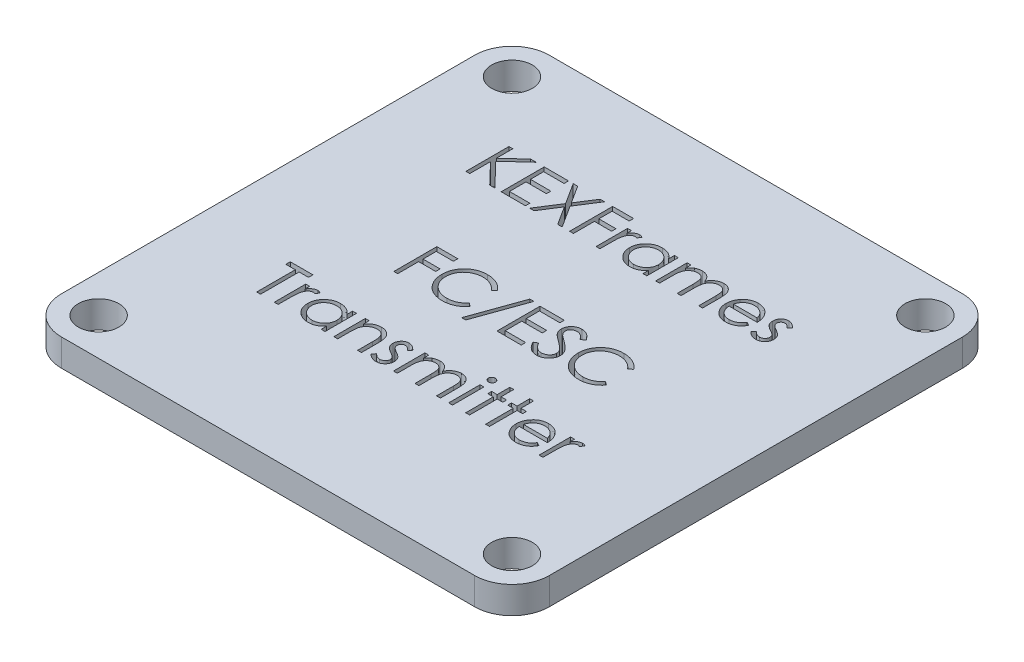
from build123d import *

# Parameters (mm, degrees)
SKETCH1_R           = 1.5
BOSS_EXTRUDE1_DEPTH = 2
SKETCH3_W           = 0.284935898
SKETCH3_H           = 2.320192308
CUT_EXTRUDE2_DEPTH  = 26.53429067


with BuildPart() as part:
    # Sketch1 → Boss-Extrude1 (new body)
    with BuildSketch(Plane(origin=(0, 0, 0), x_dir=(1, 0, 0), z_dir=(0, 1, 0))):
        with BuildLine():
            ThreePointArc((-18, -15.25), (-17.194543648, -17.194543648), (-15.25, -18))
            Line((-15.25, -18), (15.25, -18))
            ThreePointArc((15.25, -18), (17.194543648, -17.194543648), (18, -15.25))
            Line((18, -15.25), (18, 15.25))
            ThreePointArc((18, 15.25), (17.194543648, 17.194543648), (15.25, 18))
            Line((15.25, 18), (-15.25, 18))
            ThreePointArc((-15.25, 18), (-17.194543648, 17.194543648), (-18, 15.25))
            Line((-18, 15.25), (-18, -15.25))
        make_face()
        with Locations(Location((-15.25, -15.25, 0), (0, 0, 270))):
            Circle(SKETCH1_R, mode=Mode.SUBTRACT)
        with Locations(Location((15.25, -15.25, 0), (0, 0, 270))):
            Circle(SKETCH1_R, mode=Mode.SUBTRACT)
        with Locations(Location((-15.25, 15.25, 0), (0, 0, 270))):
            Circle(SKETCH1_R, mode=Mode.SUBTRACT)
        with Locations(Location((15.25, 15.25, 0), (0, 0, 270))):
            Circle(SKETCH1_R, mode=Mode.SUBTRACT)
    extrude(amount=BOSS_EXTRUDE1_DEPTH)

    # Sketch3 → Cut-Extrude2 (cut, through all)
    # profile 1 of 27: a face of its own
    with BuildSketch(Plane(origin=(0, 2, 0), x_dir=(1, 0, 0), z_dir=(0, 1, 0))):
        Polygon((-10.900686665, 10.673563512), (-10.615750768, 10.673563512), (-10.615750768, 9.464494), (-9.292198083, 10.673563512), (-8.885782819, 10.673563512), (-10.445934061, 9.248884024), (-8.763667434, 7.498563512), (-9.143369958, 7.498563512), (-10.615750768, 9.030729978), (-10.615750768, 7.498563512), (-10.900686665, 7.498563512), align=None)
    # profile 2 of 27: a face of its own
    with BuildSketch(Plane(origin=(0, 2, 0), x_dir=(1, 0, 0), z_dir=(0, 1, 0))):
        Polygon((-8.29555846, 10.673563512), (-6.504532819, 10.673563512), (-6.504532819, 10.347922486), (-8.010622562, 10.347922486), (-8.010622562, 9.370999409), (-6.504532819, 9.370999409), (-6.504532819, 9.045358383), (-8.010622562, 9.045358383), (-8.010622562, 7.824204537), (-6.504532819, 7.824204537), (-6.504532819, 7.498563512), (-8.29555846, 7.498563512), align=None)
    # profile 3 of 27: a face of its own
    with BuildSketch(Plane(origin=(0, 2, 0), x_dir=(1, 0, 0), z_dir=(0, 1, 0))):
        Polygon((-6.158539229, 10.673563512), (-5.829718115, 10.673563512), (-4.998443075, 9.374815515), (-4.167168035, 10.673563512), (-3.838346921, 10.673563512), (-4.83371451, 9.117864393), (-3.797641793, 7.498563512), (-4.126462907, 7.498563512), (-4.998443075, 8.860913271), (-5.870423244, 7.498563512), (-6.199244357, 7.498563512), (-5.162535623, 9.117864393), align=None)
    # profile 4 of 27: a face of its own
    with BuildSketch(Plane(origin=(0, 2, 0), x_dir=(1, 0, 0), z_dir=(0, 1, 0))):
        Polygon((-3.248122562, 10.673563512), (-1.701327691, 10.673563512), (-1.701327691, 10.347922486), (-2.963186665, 10.347922486), (-2.963186665, 9.370999409), (-1.701327691, 9.370999409), (-1.701327691, 9.045358383), (-2.963186665, 9.045358383), (-2.963186665, 7.498563512), (-3.248122562, 7.498563512), align=None)
    # profile 5 of 27: a face of its own
    with BuildSketch(Plane(origin=(0, 2, 0), x_dir=(1, 0, 0), z_dir=(0, 1, 0))):
        with BuildLine():
            Line((-1.294276409, 9.818755819), (-1.009340511, 9.818755819))
            Line((-1.009340511, 9.818755819), (-1.009340511, 9.477214353))
            add(Edge.make_bspline(
                [(-1.009340511, 9.477214353), (-0.988304994, 9.509014997), (-0.948074732, 9.569833482), (-0.881206574, 9.650269205), (-0.812714267, 9.71686714), (-0.742269918, 9.76993819), (-0.669355499, 9.809682947), (-0.595571264, 9.838795915), (-0.519756374, 9.856011051), (-0.468809485, 9.858309441), (-0.443284822, 9.859460947)],
                knots=[0, 0, 0, 0, 1.2804753, 2.448899062, 3.506932113, 4.484331642, 5.4025378, 6.288909075, 7.142734305, 8, 8, 8, 8], degree=3))
            add(Edge.make_bspline(
                [(-0.443284822, 9.859460947), (-0.423485226, 9.85838097), (-0.38274627, 9.856158845), (-0.321076349, 9.840546169), (-0.257536932, 9.815619677), (-0.216586338, 9.792178903), (-0.195237947, 9.779958744)],
                knots=[0, 0, 0, 0, 0.901110191, 1.854092781, 2.881294221, 4, 4, 4, 4], degree=3))
            Line((-0.195237947, 9.779958744), (-0.351698284, 9.533183904))
            add(Edge.make_bspline(
                [(-0.351698284, 9.533183904), (-0.365404324, 9.539298288), (-0.391421013, 9.55090456), (-0.429479798, 9.564640527), (-0.464569297, 9.572728536), (-0.486924524, 9.57395383), (-0.49734632, 9.57452505)],
                knots=[0, 0, 0, 0, 1.180555205, 2.24091978, 3.179933427, 4, 4, 4, 4], degree=3))
            add(Edge.make_bspline(
                [(-0.49734632, 9.57452505), (-0.520211522, 9.573001016), (-0.566849904, 9.569892429), (-0.635325128, 9.545455082), (-0.701770808, 9.505971471), (-0.754540816, 9.462182677), (-0.795400574, 9.419957175), (-0.82455635, 9.383083267), (-0.851301413, 9.341736937), (-0.876855827, 9.296625009), (-0.900138823, 9.24697722), (-0.92186913, 9.193289591), (-0.941516812, 9.135499938), (-0.952720248, 9.095238652), (-0.958459101, 9.074615194)],
                knots=[0, 0, 0, 0, 1.125678352, 2.296057538, 3.5422874, 4.923748041, 5.663163013, 6.437101912, 7.23742474, 8.08941207, 8.991984279, 9.93940061, 10.944477711, 12, 12, 12, 12], degree=3))
            add(Edge.make_bspline(
                [(-0.958459101, 9.074615194), (-0.962752058, 9.056220901), (-0.972260631, 9.015478939), (-0.981505812, 8.947127063), (-0.990640303, 8.866369887), (-0.99707795, 8.772982621), (-1.003045174, 8.667198475), (-1.006410748, 8.548856296), (-1.00922574, 8.417834613), (-1.009301093, 8.32623645), (-1.009340511, 8.278321124)],
                knots=[0, 0, 0, 0, 0.566838948, 1.255505196, 2.06880316, 3.007127437, 4.065329342, 5.249902469, 6.561414163, 8, 8, 8, 8], degree=3))
            Line((-1.009340511, 8.278321124), (-1.009340511, 7.498563512))
            Line((-1.009340511, 7.498563512), (-1.294276409, 7.498563512))
            Line((-1.294276409, 7.498563512), (-1.294276409, 9.818755819))
        make_face()
    # profile 6 of 27: a face of its own
    with BuildSketch(Plane(origin=(0, 2, 0), x_dir=(1, 0, 0), z_dir=(0, 1, 0))):
        with BuildLine():
            Line((2.450595386, 9.818755819), (2.450595386, 7.498563512))
            Line((2.450595386, 7.498563512), (2.165659489, 7.498563512))
            Line((2.165659489, 7.498563512), (2.165659489, 7.899890635))
            add(Edge.make_bspline(
                [(2.165659489, 7.899890635), (2.133529586, 7.863569003), (2.070827676, 7.792686882), (1.966106091, 7.700083769), (1.855100672, 7.623540577), (1.738350188, 7.561718868), (1.615960067, 7.51528036), (1.488201617, 7.482272915), (1.355022721, 7.461051365), (1.264079514, 7.458932259), (1.217993223, 7.457858383)],
                knots=[0, 0, 0, 0, 1.074387032, 2.096679803, 3.090159297, 4.057316773, 5.018401886, 5.985159533, 6.978961417, 8, 8, 8, 8], degree=3))
            add(Edge.make_bspline(
                [(1.217993223, 7.457858383), (1.177019436, 7.458970878), (1.096217315, 7.461164767), (0.977355223, 7.478184857), (0.86297154, 7.505517635), (0.752958177, 7.543527728), (0.648027017, 7.593947473), (0.547279643, 7.654309891), (0.451237987, 7.726192644), (0.361365948, 7.808368927), (0.278605491, 7.897627237), (0.205978479, 7.99282784), (0.1454239, 8.093559073), (0.094787112, 8.198545577), (0.055783285, 8.308595539), (0.028592917, 8.423328399), (0.011592655, 8.542608498), (0.009399673, 8.623833637), (0.008287694, 8.665019842)],
                knots=[0, 0, 0, 0, 1.033919861, 2.038935746, 3.024066025, 3.998881131, 4.97069526, 5.957263378, 6.95902576, 7.993208707, 9.027059324, 10.027763471, 11.009749337, 11.988697705, 12.965288445, 13.950418724, 14.960734635, 16, 16, 16, 16], degree=3))
            add(Edge.make_bspline(
                [(0.008287694, 8.665019842), (0.009424318, 8.705354773), (0.011671362, 8.785094756), (0.028411069, 8.902369003), (0.056560627, 9.015324854), (0.096064746, 9.123598652), (0.146721376, 9.227321412), (0.208341855, 9.326566492), (0.280930633, 9.421607303), (0.364616745, 9.510209058), (0.455271858, 9.592052044), (0.552253349, 9.66318025), (0.653148755, 9.724609105), (0.759523057, 9.773280473), (0.869801788, 9.812658732), (0.984966699, 9.839902925), (1.104538631, 9.855956923), (1.185719292, 9.858281716), (1.22689747, 9.859460947)],
                knots=[0, 0, 0, 0, 1.020392517, 2.01726096, 2.990465484, 3.961182959, 4.928053699, 5.906110375, 6.912531644, 7.948652711, 8.985773172, 9.998621852, 10.987621588, 11.969261332, 12.953316658, 13.946091881, 14.958173133, 16, 16, 16, 16], degree=3))
            add(Edge.make_bspline(
                [(1.22689747, 9.859460947), (1.274250199, 9.858156701), (1.367106666, 9.855599136), (1.50293136, 9.834315091), (1.631423137, 9.798357339), (1.75357387, 9.749446465), (1.868944921, 9.684450833), (1.976444057, 9.602463296), (2.077196317, 9.504000934), (2.135598439, 9.428372031), (2.165659489, 9.38944392)],
                knots=[0, 0, 0, 0, 1.038897134, 2.037228247, 3.008116434, 3.962042015, 4.918381754, 5.904844433, 6.921570401, 8, 8, 8, 8], degree=3))
            Line((2.165659489, 9.38944392), (2.165659489, 9.818755819))
            Line((2.165659489, 9.818755819), (2.450595386, 9.818755819))
        make_face()
        with BuildLine():
            add(Edge.make_bspline(
                [(1.230713575, 9.57452505), (1.189062712, 9.573043107), (1.106850532, 9.570117988), (0.986160616, 9.547282031), (0.870669161, 9.509286721), (0.760953794, 9.457323853), (0.658747626, 9.391983499), (0.567404082, 9.312951959), (0.48617606, 9.222385525), (0.417860706, 9.120692896), (0.362170755, 9.011674199), (0.32301209, 8.897714887), (0.297186416, 8.780870372), (0.294547972, 8.701619936), (0.293223591, 8.661839753)],
                knots=[0, 0, 0, 0, 1.031046209, 2.035121221, 3.029706178, 4.034933723, 5.034054252, 6.02443088, 7.017295772, 8.038157696, 9.050218397, 10.03989886, 11.016116709, 12, 12, 12, 12], degree=3))
            add(Edge.make_bspline(
                [(0.293223591, 8.661839753), (0.294915316, 8.622297299), (0.298292134, 8.543367383), (0.322558836, 8.426363575), (0.363271292, 8.312377408), (0.418826592, 8.202376364), (0.488392316, 8.100246501), (0.569027022, 8.007953676), (0.661510492, 7.928588121), (0.763951873, 7.862151179), (0.873360532, 7.808482321), (0.988417027, 7.771139205), (1.106958499, 7.747029361), (1.187560259, 7.744213157), (1.228169505, 7.742794281)],
                knots=[0, 0, 0, 0, 0.979072187, 1.954306742, 2.945804271, 3.96968567, 4.997920485, 5.998718438, 6.996577872, 8.005894225, 9.015743152, 10.005417472, 10.995077863, 12, 12, 12, 12], degree=3))
            add(Edge.make_bspline(
                [(1.228169505, 7.742794281), (1.269395975, 7.744300105), (1.351391336, 7.747295041), (1.472439307, 7.77022876), (1.589909737, 7.808119027), (1.702202437, 7.860641806), (1.806810642, 7.925735979), (1.900698002, 8.001942412), (1.980087488, 8.090573157), (2.047390784, 8.18797894), (2.100164197, 8.294760536), (2.138605337, 8.408456552), (2.161332808, 8.529070945), (2.16419732, 8.611497508), (2.165659489, 8.653571524)],
                knots=[0, 0, 0, 0, 1.01762866, 2.023962475, 3.030623092, 4.058876274, 5.077231937, 6.066672613, 7.034107872, 8.005628644, 8.981990164, 9.965428785, 10.961468474, 12, 12, 12, 12], degree=3))
            add(Edge.make_bspline(
                [(2.165659489, 8.653571524), (2.164788943, 8.685627985), (2.163075435, 8.748725244), (2.149984846, 8.841369492), (2.129161449, 8.930027943), (2.099818852, 9.014793811), (2.061273187, 9.095198432), (2.014784142, 9.171819129), (1.959534198, 9.244257399), (1.896412752, 9.311515757), (1.827320033, 9.372862619), (1.754209271, 9.427621609), (1.676214265, 9.47260571), (1.594646667, 9.509836006), (1.509364957, 9.53946252), (1.41967518, 9.559227071), (1.326530671, 9.57279822), (1.262988892, 9.573943379), (1.230713575, 9.57452505)],
                knots=[0, 0, 0, 0, 1.050140795, 2.067009409, 3.05949893, 4.030605086, 5.00011959, 5.97591094, 6.962425594, 7.979863591, 8.993523472, 9.986985069, 10.967611495, 11.937549037, 12.921786183, 13.919465291, 14.943216303, 16, 16, 16, 16], degree=3))
        make_face(mode=Mode.SUBTRACT)
    # profile 7 of 27: a face of its own
    with BuildSketch(Plane(origin=(0, 2, 0), x_dir=(1, 0, 0), z_dir=(0, 1, 0))):
        with BuildLine():
            Line((3.101877438, 9.818755819), (3.386813335, 9.818755819))
            Line((3.386813335, 9.818755819), (3.386813335, 9.415520643))
            add(Edge.make_bspline(
                [(3.386813335, 9.415520643), (3.412470918, 9.450797253), (3.461633307, 9.51839062), (3.542247149, 9.607463235), (3.622779765, 9.683053775), (3.680776476, 9.722734809), (3.708638255, 9.741797686)],
                knots=[0, 0, 0, 0, 1.134379233, 2.173579362, 3.122582517, 4, 4, 4, 4], degree=3))
            add(Edge.make_bspline(
                [(3.708638255, 9.741797686), (3.746615484, 9.75994541), (3.821906436, 9.795923797), (3.941122447, 9.832421382), (4.063110183, 9.854850581), (4.145486206, 9.85791797), (4.186923511, 9.859460947)],
                knots=[0, 0, 0, 0, 1.014936303, 2.012140481, 3.000054389, 4, 4, 4, 4], degree=3))
            add(Edge.make_bspline(
                [(4.186923511, 9.859460947), (4.214947872, 9.858512719), (4.270406576, 9.856636227), (4.352579287, 9.844426052), (4.432279599, 9.82332031), (4.509036611, 9.793922237), (4.581354656, 9.758319885), (4.647657, 9.716546222), (4.707187531, 9.669649589), (4.759916163, 9.615512271), (4.807331637, 9.552614071), (4.850946019, 9.479258645), (4.891246033, 9.393798839), (4.913581077, 9.331780619), (4.925339978, 9.299129417)],
                knots=[0, 0, 0, 0, 1.009824226, 1.998387844, 2.986035974, 3.974953746, 4.955485308, 5.885931332, 6.793869504, 7.679848016, 8.601185859, 9.625726857, 10.749998409, 12, 12, 12, 12], degree=3))
            add(Edge.make_bspline(
                [(4.925339978, 9.299129417), (4.937778041, 9.321557997), (4.962254404, 9.365694294), (5.003353089, 9.428158574), (5.046413162, 9.486584736), (5.091801595, 9.541019135), (5.139358184, 9.591192962), (5.18930674, 9.637272101), (5.241362935, 9.679454438), (5.313745895, 9.728733304), (5.40791876, 9.781076518), (5.526652979, 9.826459464), (5.650160634, 9.854504809), (5.733996689, 9.857797985), (5.776331564, 9.859460947)],
                knots=[0, 0, 0, 0, 0.86119277, 1.694706429, 2.50939023, 3.298075842, 4.073795165, 4.829715201, 5.57930267, 6.321991688, 7.768977793, 9.186738141, 10.579381044, 12, 12, 12, 12], degree=3))
            add(Edge.make_bspline(
                [(5.776331564, 9.859460947), (5.815231177, 9.857993897), (5.891361496, 9.855122737), (6.00219373, 9.832577086), (6.105555225, 9.793862364), (6.201238001, 9.741036136), (6.287561546, 9.674652163), (6.362597055, 9.595668289), (6.425888742, 9.504643195), (6.467235079, 9.419016176), (6.49527964, 9.343419125), (6.512570903, 9.279006275), (6.527846912, 9.208111652), (6.540529899, 9.130650486), (6.549799585, 9.046349148), (6.556667306, 8.955345597), (6.561315572, 8.857569102), (6.561644024, 8.79010897), (6.561813335, 8.755334345)],
                knots=[0, 0, 0, 0, 1.209669288, 2.367440248, 3.500751976, 4.631527125, 5.755587489, 6.87532382, 8.007944318, 9.190864318, 9.82315674, 10.514484317, 11.263564316, 12.079023757, 12.955305781, 13.901327259, 14.918167583, 16, 16, 16, 16], degree=3))
            Line((6.561813335, 8.755334345), (6.561813335, 7.498563512))
            Line((6.561813335, 7.498563512), (6.276877438, 7.498563512))
            Line((6.276877438, 7.498563512), (6.276877438, 8.75660638))
            add(Edge.make_bspline(
                [(6.276877438, 8.75660638), (6.276806787, 8.786288615), (6.276671006, 8.843333356), (6.274227497, 8.925205223), (6.269623463, 8.999834375), (6.264239897, 9.067119055), (6.256761585, 9.127216171), (6.247104204, 9.180005008), (6.236873737, 9.225900822), (6.219877516, 9.27677888), (6.1927105, 9.332903999), (6.151328929, 9.393431814), (6.099195333, 9.446119397), (6.038997191, 9.491856013), (5.970463959, 9.529043102), (5.89493096, 9.555600625), (5.812867142, 9.572040665), (5.756059327, 9.573678979), (5.726722189, 9.57452505)],
                knots=[0, 0, 0, 0, 1.253487763, 2.409012846, 3.458416907, 4.410876679, 5.259312806, 6.014470957, 6.676830364, 7.243083969, 8.276244668, 9.299465089, 10.325150304, 11.392391894, 12.482080715, 13.603491619, 14.762376348, 16, 16, 16, 16], degree=3))
            add(Edge.make_bspline(
                [(5.726722189, 9.57452505), (5.690735873, 9.573240393), (5.619613233, 9.570701422), (5.515794827, 9.544780837), (5.416035405, 9.505700896), (5.323311677, 9.449065738), (5.238015039, 9.381203865), (5.164627564, 9.300513875), (5.104001225, 9.209228155), (5.062949404, 9.12473079), (5.037014823, 9.048830651), (5.019890764, 8.982520892), (5.00657083, 8.907154042), (4.994078993, 8.823236532), (4.98592584, 8.730190726), (4.978515959, 8.628447033), (4.975049891, 8.517699442), (4.97456506, 8.440930945), (4.974313335, 8.401072526)],
                knots=[0, 0, 0, 0, 1.090531906, 2.155305635, 3.229839962, 4.33261226, 5.44038871, 6.529323825, 7.629011124, 8.757537029, 9.370236727, 10.061839251, 10.834451254, 11.692844982, 12.636905849, 13.66920014, 14.789842145, 16, 16, 16, 16], degree=3))
            Line((4.974313335, 8.401072526), (4.974313335, 7.498563512))
            Line((4.974313335, 7.498563512), (4.689377438, 7.498563512))
            Line((4.689377438, 7.498563512), (4.689377438, 8.678376212))
            add(Edge.make_bspline(
                [(4.689377438, 8.678376212), (4.689305382, 8.711662294), (4.689166755, 8.77570137), (4.686738953, 8.867534775), (4.682124661, 8.95106547), (4.676790163, 9.026196369), (4.669115573, 9.092790931), (4.660398146, 9.151206176), (4.650103335, 9.201295658), (4.633058225, 9.256235299), (4.6070101, 9.316760708), (4.565110748, 9.381295777), (4.512852443, 9.437781837), (4.451556006, 9.486004416), (4.382607994, 9.525865617), (4.306423052, 9.554585535), (4.223687167, 9.571298998), (4.166648105, 9.57342942), (4.137314136, 9.57452505)],
                knots=[0, 0, 0, 0, 1.320475261, 2.540461679, 3.643808994, 4.639130445, 5.527981419, 6.302341397, 6.981980563, 7.553956391, 8.582137848, 9.585246428, 10.591171744, 11.620968678, 12.668337649, 13.738356861, 14.836885341, 16, 16, 16, 16], degree=3))
            add(Edge.make_bspline(
                [(4.137314136, 9.57452505), (4.102828002, 9.573136704), (4.03409836, 9.57036978), (3.933131573, 9.545464832), (3.835626703, 9.506453992), (3.743139226, 9.452334014), (3.658163392, 9.385296992), (3.583770178, 9.306452765), (3.521229458, 9.216782571), (3.479744169, 9.133176188), (3.452984839, 9.059177574), (3.435209071, 8.996266357), (3.419933125, 8.926416132), (3.408581119, 8.849411396), (3.397622457, 8.765753689), (3.392333533, 8.675026259), (3.387188616, 8.577306937), (3.386941497, 8.509840413), (3.386813335, 8.474850571)],
                knots=[0, 0, 0, 0, 1.098833095, 2.189935336, 3.297829714, 4.440610912, 5.596351641, 6.740013378, 7.886572111, 9.072425424, 9.705826452, 10.395263256, 11.156850408, 11.985370555, 12.878090359, 13.847760091, 14.883794034, 16, 16, 16, 16], degree=3))
            Line((3.386813335, 8.474850571), (3.386813335, 7.498563512))
            Line((3.386813335, 7.498563512), (3.101877438, 7.498563512))
            Line((3.101877438, 7.498563512), (3.101877438, 9.818755819))
        make_face()
    # profile 8 of 27: a face of its own
    with BuildSketch(Plane(origin=(0, 2, 0), x_dir=(1, 0, 0), z_dir=(0, 1, 0))):
        with BuildLine():
            Line((9.117332165, 8.231255819), (9.370467181, 8.098328135))
            add(Edge.make_bspline(
                [(9.370467181, 8.098328135), (9.350295413, 8.062547399), (9.311049139, 7.992932255), (9.243557032, 7.897290496), (9.172807081, 7.811250068), (9.095605624, 7.737109596), (9.014262415, 7.672474411), (8.928326364, 7.615925099), (8.837350079, 7.567739013), (8.741329258, 7.527142077), (8.639457522, 7.49592775), (8.531488003, 7.473880349), (8.417213861, 7.460252098), (8.338885541, 7.458669007), (8.298777478, 7.457858383)],
                knots=[0, 0, 0, 0, 1.120438281, 2.179929193, 3.190490725, 4.156257408, 5.095198341, 6.022838206, 6.959905092, 7.901321166, 8.864066838, 9.862729781, 10.905609505, 12, 12, 12, 12], degree=3))
            add(Edge.make_bspline(
                [(8.298777478, 7.457858383), (8.254198684, 7.458899035), (8.167238371, 7.460929046), (8.040655886, 7.478430067), (7.921475985, 7.506979992), (7.809705369, 7.546863019), (7.705617754, 7.598957806), (7.609006264, 7.66242105), (7.519362837, 7.736926738), (7.439512305, 7.823120226), (7.367626782, 7.915360288), (7.304194074, 8.011477412), (7.251164833, 8.111229765), (7.208027823, 8.213982312), (7.173189124, 8.319087415), (7.1489079, 8.42750139), (7.134910914, 8.538930812), (7.132766024, 8.614311967), (7.13168513, 8.652299489)],
                knots=[0, 0, 0, 0, 1.145258523, 2.234067595, 3.276747158, 4.290159414, 5.277019952, 6.260822364, 7.254936242, 8.264827045, 9.274100331, 10.257902744, 11.220704747, 12.172965371, 13.118907548, 14.062713208, 15.023725156, 16, 16, 16, 16], degree=3))
            add(Edge.make_bspline(
                [(7.13168513, 8.652299489), (7.132645922, 8.687945514), (7.134550086, 8.758591227), (7.1465523, 8.863153543), (7.167823252, 8.964779353), (7.197011774, 9.063553103), (7.234704691, 9.15930941), (7.280816775, 9.252106553), (7.335419861, 9.341845787), (7.377577215, 9.398454344), (7.398812534, 9.42696896)],
                knots=[0, 0, 0, 0, 1.024358464, 2.0301432, 3.019427413, 4.004406732, 4.986367066, 5.972626655, 6.978780325, 8, 8, 8, 8], degree=3))
            add(Edge.make_bspline(
                [(7.398812534, 9.42696896), (7.427575932, 9.461321435), (7.484191576, 9.528938186), (7.57994627, 9.617782239), (7.683632877, 9.692207663), (7.793951995, 9.753899851), (7.912185796, 9.800775231), (8.036744939, 9.835707109), (8.16904772, 9.855281448), (8.259494599, 9.858046268), (8.305773672, 9.859460947)],
                knots=[0, 0, 0, 0, 1.030682036, 2.02871468, 2.997146059, 3.962720338, 4.930598197, 5.918074684, 6.934738563, 8, 8, 8, 8], degree=3))
            add(Edge.make_bspline(
                [(8.305773672, 9.859460947), (8.353351142, 9.858232632), (8.446687294, 9.855822956), (8.582787861, 9.833483354), (8.711566511, 9.798057108), (8.832971711, 9.748024741), (8.94701577, 9.683472861), (9.052957401, 9.60351562), (9.152608416, 9.510607783), (9.210582627, 9.4391583), (9.240083567, 9.40280029)],
                knots=[0, 0, 0, 0, 1.056321875, 2.072262726, 3.055038591, 4.01806755, 4.982017516, 5.957941055, 6.960871419, 8, 8, 8, 8], degree=3))
            add(Edge.make_bspline(
                [(9.240083567, 9.40280029), (9.260155861, 9.375401327), (9.300166842, 9.320785777), (9.350283854, 9.231730513), (9.393788063, 9.138557331), (9.428561535, 9.039760133), (9.456718796, 8.936509514), (9.477090339, 8.828067348), (9.489037064, 8.714465928), (9.491385383, 8.637062553), (9.492582566, 8.597601973)],
                knots=[0, 0, 0, 0, 0.94817472, 1.890038105, 2.849395472, 3.817997239, 4.812318967, 5.836947057, 6.897266129, 8, 8, 8, 8], degree=3))
            Line((9.492582566, 8.597601973), (7.416621027, 8.597601973))
            add(Edge.make_bspline(
                [(7.416621027, 8.597601973), (7.41801767, 8.567030838), (7.420764112, 8.506913933), (7.433568564, 8.41894758), (7.45375138, 8.335151762), (7.482116887, 8.256155003), (7.516467525, 8.18092553), (7.558545997, 8.110021396), (7.608746878, 8.04376556), (7.664740905, 7.981565371), (7.727068056, 7.926174537), (7.792638834, 7.876597569), (7.862392282, 7.835045349), (7.9357784, 7.801317877), (8.01267852, 7.774914291), (8.093116868, 7.756891339), (8.176935159, 7.744819892), (8.234072218, 7.743477624), (8.26316049, 7.742794281)],
                knots=[0, 0, 0, 0, 1.094153842, 2.151609401, 3.174256925, 4.172055639, 5.149267565, 6.128595816, 7.11444997, 8.118368179, 9.117203808, 10.09244225, 11.054858984, 12.015122123, 12.976791628, 13.957293641, 14.960065497, 16, 16, 16, 16], degree=3))
            add(Edge.make_bspline(
                [(8.26316049, 7.742794281), (8.29160046, 7.743345875), (8.348030815, 7.744440344), (8.432069307, 7.755082863), (8.514745879, 7.772291613), (8.595718342, 7.795777533), (8.673343324, 7.824422248), (8.745230358, 7.858986984), (8.811343125, 7.897222825), (8.873134945, 7.940955888), (8.933070775, 7.994484743), (8.992527173, 8.061282861), (9.056278137, 8.14028369), (9.096182982, 8.199742973), (9.117332165, 8.231255819)],
                knots=[0, 0, 0, 0, 0.99110716, 1.966546729, 2.947904876, 3.932708344, 4.903319531, 5.828989031, 6.710028674, 7.56322171, 8.463672341, 9.504779593, 10.677557249, 12, 12, 12, 12], degree=3))
        make_face()
        with BuildLine():
            add(Edge.make_bspline(
                [(9.207646668, 8.88253787), (9.197217587, 8.920332049), (9.177144964, 8.993073676), (9.135201976, 9.093803627), (9.08796565, 9.183327651), (9.032065937, 9.260960604), (8.968730378, 9.329906648), (8.895573677, 9.390157793), (8.813535402, 9.444057909), (8.72303961, 9.489553391), (8.627207419, 9.528279191), (8.526871802, 9.554246261), (8.424493666, 9.572034917), (8.355247564, 9.573691458), (8.320402077, 9.57452505)],
                knots=[0, 0, 0, 0, 1.154881502, 2.222775134, 3.210006277, 4.132804581, 5.035138423, 5.962687519, 6.919655026, 7.923214229, 8.944639381, 9.960483929, 10.97369054, 12, 12, 12, 12], degree=3))
            add(Edge.make_bspline(
                [(8.320402077, 9.57452505), (8.291963658, 9.573970176), (8.235746882, 9.572873308), (8.15292377, 9.562468262), (8.073385757, 9.545268975), (7.996545961, 9.52171505), (7.923411316, 9.490320103), (7.85247749, 9.453505319), (7.785548131, 9.408564025), (7.743691384, 9.37431135), (7.722545506, 9.357007021)],
                knots=[0, 0, 0, 0, 1.04873581, 2.073130211, 3.073294108, 4.04793562, 5.032784715, 6.005352987, 6.992311501, 8, 8, 8, 8], degree=3))
            add(Edge.make_bspline(
                [(7.722545506, 9.357007021), (7.707402315, 9.343314321), (7.676756186, 9.315603632), (7.635807284, 9.267861423), (7.596600141, 9.216379649), (7.560918899, 9.159188714), (7.528191374, 9.096939865), (7.497566252, 9.030158153), (7.470001436, 8.958336813), (7.454492821, 8.908287529), (7.446513856, 8.88253787)],
                knots=[0, 0, 0, 0, 0.879870761, 1.780643979, 2.707998968, 3.669668524, 4.684282772, 5.740141944, 6.837334558, 8, 8, 8, 8], degree=3))
            Line((7.446513856, 8.88253787), (9.207646668, 8.88253787))
        make_face(mode=Mode.SUBTRACT)
    # profile 9 of 27: a face of its own
    with BuildSketch(Plane(origin=(0, 2, 0), x_dir=(1, 0, 0), z_dir=(0, 1, 0))):
        with BuildLine():
            Line((11.161492822, 9.529367798), (10.968143463, 9.330294281))
            add(Edge.make_bspline(
                [(10.968143463, 9.330294281), (10.951460649, 9.349628349), (10.919298148, 9.386902157), (10.868288162, 9.436737925), (10.81746675, 9.478590719), (10.767529612, 9.513925983), (10.717221039, 9.540640566), (10.667131406, 9.560139476), (10.617208851, 9.572206114), (10.583838662, 9.573761355), (10.567452357, 9.57452505)],
                knots=[0, 0, 0, 0, 1.26578478, 2.440284043, 3.530471711, 4.527705817, 5.468200915, 6.346673037, 7.188140097, 8, 8, 8, 8], degree=3))
            add(Edge.make_bspline(
                [(10.567452357, 9.57452505), (10.547368768, 9.573549987), (10.507847107, 9.5716312), (10.451217971, 9.552478302), (10.398648476, 9.523078947), (10.35314893, 9.481378875), (10.314606534, 9.433514145), (10.286472695, 9.37999605), (10.269267838, 9.322439611), (10.267086403, 9.28249824), (10.265980002, 9.262240395)],
                knots=[0, 0, 0, 0, 0.99966794, 1.967205029, 2.953328237, 3.988086729, 5.028030931, 6.008226631, 6.989793394, 8, 8, 8, 8], degree=3))
            add(Edge.make_bspline(
                [(10.265980002, 9.262240395), (10.266987667, 9.243905183), (10.269000157, 9.207286447), (10.284645359, 9.153267873), (10.30956101, 9.100601846), (10.332847544, 9.068341209), (10.344846188, 9.05171856)],
                knots=[0, 0, 0, 0, 0.960159726, 1.917612774, 2.927026955, 4, 4, 4, 4], degree=3))
            add(Edge.make_bspline(
                [(10.344846188, 9.05171856), (10.352070214, 9.042842544), (10.367445644, 9.023951063), (10.396300511, 8.997731139), (10.428978067, 8.968754954), (10.468275439, 8.93978368), (10.512499586, 8.909274901), (10.562609508, 8.878430109), (10.617014952, 8.844898095), (10.655965223, 8.823630643), (10.676211372, 8.812575931)],
                knots=[0, 0, 0, 0, 0.66740084, 1.420478572, 2.27185888, 3.217733974, 4.268547843, 5.408967954, 6.65319498, 8, 8, 8, 8], degree=3))
            add(Edge.make_bspline(
                [(10.676211372, 8.812575931), (10.700897974, 8.798746627), (10.74858436, 8.772032964), (10.816341371, 8.730567733), (10.877833901, 8.689354941), (10.933582971, 8.648835342), (10.982515897, 8.607875241), (11.026117313, 8.568044633), (11.063299687, 8.528140046), (11.084122178, 8.500260721), (11.094074954, 8.486934906)],
                knots=[0, 0, 0, 0, 1.27191281, 2.456916733, 3.569705269, 4.599008579, 5.553216877, 6.436649441, 7.252746552, 8, 8, 8, 8], degree=3))
            add(Edge.make_bspline(
                [(11.094074954, 8.486934906), (11.110594503, 8.460023526), (11.143471474, 8.406464885), (11.177995758, 8.318273883), (11.198007579, 8.224737927), (11.20078545, 8.160755128), (11.20219795, 8.128220963)],
                knots=[0, 0, 0, 0, 0.995354457, 1.980940102, 2.973342416, 4, 4, 4, 4], degree=3))
            add(Edge.make_bspline(
                [(11.20219795, 8.128220963), (11.20154523, 8.105298238), (11.200258974, 8.060126503), (11.191316299, 7.993601336), (11.175935714, 7.929979273), (11.15498638, 7.868569979), (11.126697699, 7.810550084), (11.093543626, 7.754455773), (11.053742813, 7.701500464), (11.008302779, 7.651753693), (10.958550081, 7.606318765), (10.905476656, 7.56638275), (10.849017145, 7.533204601), (10.789574975, 7.505749609), (10.727015089, 7.483916261), (10.661327705, 7.468800965), (10.59272162, 7.459754246), (10.546067437, 7.458498328), (10.522295106, 7.457858383)],
                knots=[0, 0, 0, 0, 1.032770009, 2.035186124, 3.017557409, 3.978232242, 4.952395191, 5.920591857, 6.910227898, 7.931268572, 8.952309245, 9.941945286, 10.918353717, 11.897095711, 12.887975737, 13.898235213, 14.929059601, 16, 16, 16, 16], degree=3))
            add(Edge.make_bspline(
                [(10.522295106, 7.457858383), (10.490212025, 7.458758904), (10.426491656, 7.460547434), (10.332248839, 7.477335075), (10.240155008, 7.503456611), (10.150907082, 7.539484637), (10.066500965, 7.584978498), (9.989275054, 7.639463669), (9.918961085, 7.70114031), (9.878939508, 7.748414164), (9.85892872, 7.772051092)],
                knots=[0, 0, 0, 0, 1.013940152, 2.01379169, 3.017749504, 4.037548394, 5.051665909, 6.043208538, 7.021604269, 8, 8, 8, 8], degree=3))
            Line((9.85892872, 7.772051092), (10.047825955, 7.98702505))
            add(Edge.make_bspline(
                [(10.047825955, 7.98702505), (10.065762358, 7.967653228), (10.100534788, 7.930098022), (10.156143749, 7.88009237), (10.212730777, 7.838181217), (10.269730814, 7.803126119), (10.327987614, 7.776115575), (10.387174707, 7.757139422), (10.447171706, 7.744943619), (10.487468929, 7.743511891), (10.5076667, 7.742794281)],
                knots=[0, 0, 0, 0, 1.179806542, 2.287233372, 3.337373186, 4.324005949, 5.273901747, 6.200048787, 7.097828587, 8, 8, 8, 8], degree=3))
            add(Edge.make_bspline(
                [(10.5076667, 7.742794281), (10.53516939, 7.744037815), (10.588905033, 7.746467472), (10.665870443, 7.768526548), (10.736934768, 7.803115861), (10.79864166, 7.852178409), (10.851167192, 7.909288107), (10.889202036, 7.973617344), (10.913038281, 8.043278165), (10.915837722, 8.091567468), (10.917262053, 8.116136628)],
                knots=[0, 0, 0, 0, 1.072336372, 2.095165389, 3.102688358, 4.141489647, 5.156069229, 6.117746104, 7.042326257, 8, 8, 8, 8], degree=3))
            add(Edge.make_bspline(
                [(10.917262053, 8.116136628), (10.916276629, 8.13637464), (10.914331041, 8.176331884), (10.899051787, 8.23416255), (10.874910128, 8.289016826), (10.851138768, 8.321120292), (10.839031885, 8.337470763)],
                knots=[0, 0, 0, 0, 1.013901739, 2.00181326, 2.98231254, 4, 4, 4, 4], degree=3))
            add(Edge.make_bspline(
                [(10.839031885, 8.337470763), (10.831754427, 8.345667127), (10.815901495, 8.363521769), (10.786822812, 8.389307376), (10.75200498, 8.417100509), (10.711056404, 8.446429879), (10.663894535, 8.476908614), (10.610328225, 8.508376812), (10.551091295, 8.542329106), (10.509207937, 8.564844079), (10.487314136, 8.576613391)],
                knots=[0, 0, 0, 0, 0.615000592, 1.339693406, 2.178160186, 3.116406724, 4.166410947, 5.330106347, 6.604359322, 8, 8, 8, 8], degree=3))
            add(Edge.make_bspline(
                [(10.487314136, 8.576613391), (10.463686113, 8.589802461), (10.417863835, 8.615380276), (10.352960221, 8.655218434), (10.294406549, 8.695738033), (10.240793885, 8.734666109), (10.193476402, 8.774055108), (10.152640506, 8.813948758), (10.116678446, 8.852738173), (10.096769008, 8.88022215), (10.087259048, 8.89335017)],
                knots=[0, 0, 0, 0, 1.262093308, 2.447601706, 3.550203992, 4.582594899, 5.537233252, 6.418365656, 7.244515135, 8, 8, 8, 8], degree=3))
            add(Edge.make_bspline(
                [(10.087259048, 8.89335017), (10.070812004, 8.919789407), (10.037912169, 8.972677119), (10.005966959, 9.060951623), (9.984008633, 9.153883925), (9.982047037, 9.218007), (9.981044104, 9.250792077)],
                knots=[0, 0, 0, 0, 0.985009483, 1.970363186, 2.962279964, 4, 4, 4, 4], degree=3))
            add(Edge.make_bspline(
                [(9.981044104, 9.250792077), (9.981528696, 9.272223688), (9.98247711, 9.314168387), (9.990046357, 9.375798603), (10.003827409, 9.434353), (10.021112946, 9.49071094), (10.045136814, 9.543780696), (10.073844171, 9.594269974), (10.107578478, 9.642108985), (10.146443463, 9.686561826), (10.18917592, 9.726938144), (10.235344747, 9.762134042), (10.283911594, 9.792166235), (10.335082089, 9.817353202), (10.389347803, 9.836404456), (10.446329425, 9.84951937), (10.505911616, 9.858278018), (10.546643352, 9.859060959), (10.567452357, 9.859460947)],
                knots=[0, 0, 0, 0, 1.087655834, 2.128696564, 3.144119009, 4.137814668, 5.115653402, 6.093965665, 7.082169637, 8.081268856, 9.086088321, 10.061021666, 11.022561449, 11.980240094, 12.950172527, 13.934149372, 14.944599409, 16, 16, 16, 16], degree=3))
            add(Edge.make_bspline(
                [(10.567452357, 9.859460947), (10.592119444, 9.858459153), (10.641916345, 9.85643677), (10.716623756, 9.84037518), (10.791221144, 9.813947292), (10.865900183, 9.777447281), (10.940113803, 9.730215186), (11.014514809, 9.673129322), (11.089996379, 9.606565252), (11.137128177, 9.555675241), (11.161492822, 9.529367798)],
                knots=[0, 0, 0, 0, 0.845714091, 1.707292901, 2.609013841, 3.555613372, 4.552488639, 5.621697636, 6.770543573, 8, 8, 8, 8], degree=3))
        make_face()
    # profile 10 of 27: a face of its own
    with BuildSketch(Plane(origin=(0, 2, 0), x_dir=(1, 0, 0), z_dir=(0, 1, 0))):
        Polygon((-7.163383445, 1.617790325), (-5.616588573, 1.617790325), (-5.616588573, 1.292149299), (-6.878447548, 1.292149299), (-6.878447548, 0.315226223), (-5.616588573, 0.315226223), (-5.616588573, -0.010414803), (-6.878447548, -0.010414803), (-6.878447548, -1.557209675), (-7.163383445, -1.557209675), align=None)
    # profile 11 of 27: a face of its own
    with BuildSketch(Plane(origin=(0, 2, 0), x_dir=(1, 0, 0), z_dir=(0, 1, 0))):
        with BuildLine():
            Line((-2.115947548, 1.035198178), (-2.365266458, 0.844392889))
            add(Edge.make_bspline(
                [(-2.365266458, 0.844392889), (-2.3830518, 0.865589162), (-2.418382698, 0.907695935), (-2.475223546, 0.966823094), (-2.534461465, 1.022218009), (-2.59607381, 1.074144572), (-2.661169583, 1.120786923), (-2.728171879, 1.16457571), (-2.798201534, 1.203825729), (-2.895040608, 1.251417152), (-3.021721156, 1.301079736), (-3.181192189, 1.342720524), (-3.347662971, 1.369228305), (-3.461235079, 1.372099268), (-3.519002436, 1.373559556)],
                knots=[0, 0, 0, 0, 0.757959112, 1.505699292, 2.245454638, 2.979532153, 3.711538275, 4.438200793, 5.171680507, 5.909471876, 7.393775596, 8.890124382, 10.418191784, 12, 12, 12, 12], degree=3))
            add(Edge.make_bspline(
                [(-3.519002436, 1.373559556), (-3.550828, 1.373193104), (-3.614183758, 1.372463602), (-3.70820773, 1.36283961), (-3.800475998, 1.349313012), (-3.890928542, 1.329242183), (-3.979450226, 1.303867021), (-4.066619762, 1.273545396), (-4.151175092, 1.236030648), (-4.234285922, 1.194566727), (-4.313914207, 1.147733259), (-4.389257, 1.096649004), (-4.460039514, 1.04188561), (-4.52631774, 0.98323782), (-4.588159436, 0.920969756), (-4.645116497, 0.854417818), (-4.696991833, 0.783794774), (-4.744813706, 0.710031898), (-4.7876424, 0.633344044), (-4.823501648, 0.553447373), (-4.855256294, 0.471710079), (-4.880383464, 0.387208669), (-4.900272133, 0.300537731), (-4.913995085, 0.21146466), (-4.923509627, 0.120175536), (-4.924235501, 0.058299945), (-4.924601394, 0.027110237)],
                knots=[0, 0, 0, 0, 1.054917814, 2.100044995, 3.131103042, 4.146048494, 5.169673617, 6.183595914, 7.203665975, 8.234915748, 9.262203917, 10.264457458, 11.251630812, 12.227803204, 13.197192746, 14.159520551, 15.12972552, 16.100847026, 17.073214652, 18.039054194, 19.002613845, 19.979014051, 20.95965708, 21.949030935, 22.966165397, 24, 24, 24, 24], degree=3))
            add(Edge.make_bspline(
                [(-4.924601394, 0.027110237), (-4.923456744, -0.01981746), (-4.921209375, -0.11195377), (-4.901208386, -0.246909966), (-4.870814482, -0.376196577), (-4.82526178, -0.499005434), (-4.769092356, -0.616850873), (-4.698116944, -0.727738976), (-4.615914799, -0.833345431), (-4.521323004, -0.931174391), (-4.417540586, -1.020540413), (-4.306190694, -1.099235584), (-4.187550662, -1.164835513), (-4.062930433, -1.219423693), (-3.93137103, -1.261385153), (-3.793109031, -1.290925465), (-3.648445149, -1.310195157), (-3.549594336, -1.312040003), (-3.499285889, -1.312978906)],
                knots=[0, 0, 0, 0, 1.029171465, 2.020641659, 2.987623507, 3.938342917, 4.889210282, 5.84687017, 6.821220943, 7.821438502, 8.827599549, 9.822697543, 10.807740252, 11.797342354, 12.80366471, 13.83203677, 14.896651826, 16, 16, 16, 16], degree=3))
            add(Edge.make_bspline(
                [(-3.499285889, -1.312978906), (-3.443857021, -1.311446941), (-3.33475975, -1.308431669), (-3.174768754, -1.282887207), (-3.021610595, -1.241468953), (-2.875277035, -1.183504409), (-2.736180606, -1.108152326), (-2.604103635, -1.016804966), (-2.478934639, -0.908593407), (-2.403667833, -0.825967998), (-2.365266458, -0.783812239)],
                knots=[0, 0, 0, 0, 1.028121516, 2.023589091, 2.998037872, 3.967518031, 4.937445131, 5.927275754, 6.942489185, 8, 8, 8, 8], degree=3))
            Line((-2.365266458, -0.783812239), (-2.115947548, -0.972709475))
            add(Edge.make_bspline(
                [(-2.115947548, -0.972709475), (-2.136011833, -0.998597927), (-2.176044297, -1.050250829), (-2.240866927, -1.123068737), (-2.30915419, -1.191561683), (-2.381413298, -1.255177454), (-2.456813009, -1.315189005), (-2.536707178, -1.369891381), (-2.620045514, -1.420048111), (-2.706545649, -1.465973964), (-2.796115676, -1.506720324), (-2.888648271, -1.541603385), (-2.983744579, -1.571652392), (-3.081408947, -1.596373792), (-3.181843955, -1.615669703), (-3.284687171, -1.62856898), (-3.390160558, -1.637406288), (-3.461318132, -1.638211754), (-3.497377836, -1.638619931)],
                knots=[0, 0, 0, 0, 0.986787822, 1.968848986, 2.935600012, 3.899624008, 4.868462664, 5.837806735, 6.815139263, 7.798259679, 8.787526145, 9.778297419, 10.776456485, 11.791383307, 12.812564526, 13.85620153, 14.913611965, 16, 16, 16, 16], degree=3))
            add(Edge.make_bspline(
                [(-3.497377836, -1.638619931), (-3.53152602, -1.638382267), (-3.599049825, -1.637912314), (-3.698743692, -1.630299419), (-3.795798526, -1.619912872), (-3.889936937, -1.604273611), (-3.981672643, -1.585818388), (-4.07017403, -1.561079462), (-4.156311971, -1.533367004), (-4.239740394, -1.500796052), (-4.320530265, -1.464042086), (-4.398421008, -1.422502601), (-4.4733768, -1.376526909), (-4.546134575, -1.327128435), (-4.615619526, -1.272720454), (-4.682433795, -1.214058579), (-4.746952041, -1.151340526), (-4.786868763, -1.106115052), (-4.806938133, -1.083376542)],
                knots=[0, 0, 0, 0, 1.114604814, 2.203992996, 3.262667896, 4.300477797, 5.318619304, 6.316056647, 7.298880507, 8.271930387, 9.238335007, 10.195173496, 11.151986948, 12.108099108, 13.064862484, 14.031167946, 15.010108607, 16, 16, 16, 16], degree=3))
            add(Edge.make_bspline(
                [(-4.806938133, -1.083376542), (-4.839083324, -1.043878463), (-4.90298562, -0.965359162), (-4.984742491, -0.838099736), (-5.054726344, -0.705232146), (-5.111310215, -0.566058354), (-5.15554498, -0.420890653), (-5.18618935, -0.269655865), (-5.206102591, -0.112495231), (-5.208379782, -0.00560043), (-5.209537291, 0.048734836)],
                knots=[0, 0, 0, 0, 0.994628077, 1.977248131, 2.950237994, 3.925870899, 4.908910175, 5.911660606, 6.938484602, 8, 8, 8, 8], degree=3))
            add(Edge.make_bspline(
                [(-5.209537291, 0.048734836), (-5.208126509, 0.105844426), (-5.205350882, 0.218203979), (-5.181768982, 0.383098923), (-5.143833359, 0.54107912), (-5.089951896, 0.69184966), (-5.021639185, 0.836203557), (-4.937250756, 0.973038079), (-4.837766992, 1.103228318), (-4.723968127, 1.224798843), (-4.599174901, 1.335959541), (-4.465535691, 1.433755169), (-4.323312068, 1.515141773), (-4.174070874, 1.583174006), (-4.016694577, 1.635465769), (-3.851518949, 1.672071874), (-3.678854362, 1.694856686), (-3.56105059, 1.697737053), (-3.501193942, 1.699200581)],
                knots=[0, 0, 0, 0, 1.032925535, 2.032216505, 3.007276963, 3.968222605, 4.92396291, 5.891752235, 6.871517503, 7.883894988, 8.900124299, 9.891468569, 10.874487609, 11.85992873, 12.854644235, 13.869047385, 14.917252991, 16, 16, 16, 16], degree=3))
            add(Edge.make_bspline(
                [(-3.501193942, 1.699200581), (-3.464713671, 1.698763213), (-3.392504648, 1.697897487), (-3.285686171, 1.689455487), (-3.181689203, 1.67538243), (-3.080442098, 1.656227138), (-2.981452296, 1.632453353), (-2.885476363, 1.601483225), (-2.791951126, 1.566071515), (-2.701466431, 1.525287764), (-2.614456417, 1.47950722), (-2.530948185, 1.429237333), (-2.451605064, 1.374540423), (-2.375868751, 1.315881686), (-2.305006188, 1.252020135), (-2.237005418, 1.184712316), (-2.174175726, 1.11201949), (-2.135392471, 1.060852157), (-2.115947548, 1.035198178)],
                knots=[0, 0, 0, 0, 1.096760587, 2.17092713, 3.219439832, 4.250915756, 5.268269357, 6.278326846, 7.281116186, 8.274029601, 9.260640565, 10.235837813, 11.203064059, 12.156899882, 13.114053108, 14.069676657, 15.032185724, 16, 16, 16, 16], degree=3))
        make_face()
    # profile 12 of 27: a face of its own
    with BuildSketch(Plane(origin=(0, 2, 0), x_dir=(1, 0, 0), z_dir=(0, 1, 0))):
        Polygon((-0.080691138, 1.699200581), (-1.408695945, -2.004966085), (-1.708896266, -2.004966085), (-0.380891458, 1.699200581), align=None)
    # profile 13 of 27: a face of its own
    with BuildSketch(Plane(origin=(0, 2, 0), x_dir=(1, 0, 0), z_dir=(0, 1, 0))):
        Polygon((0.448475529, 1.617790325), (2.23950117, 1.617790325), (2.23950117, 1.292149299), (0.733411427, 1.292149299), (0.733411427, 0.315226223), (2.23950117, 0.315226223), (2.23950117, -0.010414803), (0.733411427, -0.010414803), (0.733411427, -1.231568649), (2.23950117, -1.231568649), (2.23950117, -1.557209675), (0.448475529, -1.557209675), align=None)
    # profile 14 of 27: a face of its own
    with BuildSketch(Plane(origin=(0, 2, 0), x_dir=(1, 0, 0), z_dir=(0, 1, 0))):
        with BuildLine():
            Line((2.483731939, -0.944724699), (2.752131378, -0.783812239))
            add(Edge.make_bspline(
                [(2.752131378, -0.783812239), (2.777094351, -0.825599217), (2.824922443, -0.905661454), (2.90470689, -1.013845533), (2.987377459, -1.10579549), (3.073546355, -1.180976412), (3.162687608, -1.240166474), (3.255383142, -1.282078498), (3.351320585, -1.308218704), (3.416611123, -1.311393783), (3.449206699, -1.312978906)],
                knots=[0, 0, 0, 0, 1.272034388, 2.437168799, 3.508375237, 4.49857839, 5.41946034, 6.295179144, 7.148887113, 8, 8, 8, 8], degree=3))
            add(Edge.make_bspline(
                [(3.449206699, -1.312978906), (3.477044065, -1.312203596), (3.532231709, -1.310666542), (3.613477458, -1.295897528), (3.692382379, -1.273207954), (3.767320215, -1.240713252), (3.837256951, -1.201399054), (3.898585882, -1.153913593), (3.951604856, -1.100749392), (3.994974552, -1.041437984), (4.028248584, -0.977650285), (4.053822818, -0.912176386), (4.068015135, -0.843987757), (4.070153047, -0.798076837), (4.071231939, -0.774907992)],
                knots=[0, 0, 0, 0, 1.095163259, 2.171163733, 3.241058638, 4.321873601, 5.38011039, 6.391990106, 7.366004449, 8.327778327, 9.272591725, 10.192022065, 11.087607919, 12, 12, 12, 12], degree=3))
            add(Edge.make_bspline(
                [(4.071231939, -0.774907992), (4.069894529, -0.748473079), (4.067175769, -0.694734762), (4.044196498, -0.615450791), (4.008047538, -0.536989674), (3.974698569, -0.488456383), (3.957384784, -0.463259354)],
                knots=[0, 0, 0, 0, 0.938893495, 1.908633276, 2.914225137, 4, 4, 4, 4], degree=3))
            add(Edge.make_bspline(
                [(3.957384784, -0.463259354), (3.943169298, -0.445074022), (3.913325664, -0.40689619), (3.862019921, -0.350068012), (3.801816374, -0.291449875), (3.734775292, -0.228803445), (3.658454561, -0.165042372), (3.575244602, -0.097126148), (3.483020958, -0.027637575), (3.418342129, 0.018964681), (3.384968919, 0.043010678)],
                knots=[0, 0, 0, 0, 0.722233717, 1.516239348, 2.393582979, 3.351407094, 4.387010283, 5.505090956, 6.712668013, 8, 8, 8, 8], degree=3))
            add(Edge.make_bspline(
                [(3.384968919, 0.043010678), (3.351564293, 0.066803754), (3.287697194, 0.112294303), (3.198381194, 0.179807761), (3.118512289, 0.241533271), (3.048445466, 0.29805191), (2.988211546, 0.349371345), (2.937335881, 0.394998761), (2.897114475, 0.436168134), (2.874748341, 0.462875637), (2.864706499, 0.474866647)],
                knots=[0, 0, 0, 0, 1.452282411, 2.77665338, 3.964542531, 5.026858415, 5.96415736, 6.766646006, 7.446254459, 8, 8, 8, 8], degree=3))
            add(Edge.make_bspline(
                [(2.864706499, 0.474866647), (2.85067069, 0.493554731), (2.823067388, 0.530307355), (2.786631083, 0.587752047), (2.755661985, 0.646556009), (2.731384727, 0.706877258), (2.710941157, 0.767868943), (2.697190748, 0.830326859), (2.688580695, 0.893970749), (2.687698965, 0.936800139), (2.68725758, 0.958240045)],
                knots=[0, 0, 0, 0, 1.068054152, 2.10047183, 3.106115577, 4.101338837, 5.06977816, 6.043150881, 7.020423561, 8, 8, 8, 8], degree=3))
            add(Edge.make_bspline(
                [(2.68725758, 0.958240045), (2.688441591, 0.99183134), (2.690784306, 1.058295941), (2.710596775, 1.155388194), (2.741868615, 1.248085873), (2.785678977, 1.335471247), (2.84215529, 1.415268958), (2.907511281, 1.488396907), (2.985354558, 1.549872692), (3.070764438, 1.603586488), (3.164251289, 1.645628863), (3.262214466, 1.677343466), (3.364809667, 1.695313293), (3.434299654, 1.697892087), (3.469559263, 1.699200581)],
                knots=[0, 0, 0, 0, 1.005424448, 1.989358655, 2.955360095, 3.929531133, 4.905563448, 5.876582895, 6.856512386, 7.866279853, 8.892233794, 9.918561126, 10.94386622, 12, 12, 12, 12], degree=3))
            add(Edge.make_bspline(
                [(3.469559263, 1.699200581), (3.506973554, 1.697910124), (3.581378637, 1.695343816), (3.690824712, 1.673030341), (3.796199076, 1.636109017), (3.880965466, 1.594209306), (3.947307328, 1.552361522), (3.997901164, 1.514243538), (4.049170566, 1.470360404), (4.101529087, 1.420595231), (4.154089543, 1.364491392), (4.207632246, 1.302433125), (4.262282404, 1.234799678), (4.297439505, 1.186517452), (4.315462709, 1.161765686)],
                knots=[0, 0, 0, 0, 1.286793592, 2.559021753, 3.825965368, 5.121522368, 5.803751409, 6.523245864, 7.299691795, 8.125521123, 9.008227632, 9.944561021, 10.946284179, 12, 12, 12, 12], degree=3))
            Line((4.315462709, 1.161765686), (4.057875569, 0.966508274))
            add(Edge.make_bspline(
                [(4.057875569, 0.966508274), (4.042321759, 0.986545872), (4.012368757, 1.0251336), (3.966894151, 1.079173293), (3.924032878, 1.128536814), (3.881805015, 1.171413037), (3.842440792, 1.210149973), (3.804234618, 1.243314895), (3.767736314, 1.271232756), (3.721728831, 1.301026557), (3.663927758, 1.330559957), (3.591370357, 1.355550906), (3.515545665, 1.370568712), (3.463902356, 1.372554346), (3.437758382, 1.373559556)],
                knots=[0, 0, 0, 0, 1.181633172, 2.275549214, 3.290209073, 4.226197932, 5.078386478, 5.862611352, 6.581680152, 7.217281963, 8.414376989, 9.595101626, 10.782541182, 12, 12, 12, 12], degree=3))
            add(Edge.make_bspline(
                [(3.437758382, 1.373559556), (3.404959251, 1.372460371), (3.341709216, 1.370340696), (3.251910931, 1.347190424), (3.171090013, 1.310739736), (3.1016459, 1.259654006), (3.043827357, 1.199128534), (3.002003119, 1.129479144), (2.976829756, 1.052569393), (2.973757916, 0.998919462), (2.972193478, 0.971596415)],
                knots=[0, 0, 0, 0, 1.14458467, 2.207223713, 3.21896685, 4.227309161, 5.202851033, 6.127160689, 7.046193047, 8, 8, 8, 8], degree=3))
            add(Edge.make_bspline(
                [(2.972193478, 0.971596415), (2.9725501, 0.954586145), (2.973263927, 0.92053779), (2.983219636, 0.870235429), (2.996009742, 0.820060142), (3.016277701, 0.770237514), (3.044258798, 0.719896202), (3.081002779, 0.66816934), (3.12727914, 0.614601005), (3.162727573, 0.57976003), (3.181443278, 0.561365045)],
                knots=[0, 0, 0, 0, 0.858281714, 1.717966888, 2.583508476, 3.4729293, 4.427298488, 5.488583878, 6.674047936, 8, 8, 8, 8], degree=3))
            add(Edge.make_bspline(
                [(3.181443278, 0.561365045), (3.188393237, 0.555162886), (3.204904749, 0.540427975), (3.235090767, 0.516304978), (3.274953163, 0.486548177), (3.323451017, 0.449729683), (3.381478552, 0.407020071), (3.44904215, 0.358965437), (3.525388683, 0.30400577), (3.579564992, 0.26558143), (3.608211106, 0.245264283)],
                knots=[0, 0, 0, 0, 0.420754252, 0.999615792, 1.744751191, 2.668019286, 3.750313428, 4.999500688, 6.413464383, 8, 8, 8, 8], degree=3))
            add(Edge.make_bspline(
                [(3.608211106, 0.245264283), (3.642669756, 0.220189622), (3.709394156, 0.171636014), (3.804333532, 0.098687504), (3.890415772, 0.027342743), (3.967943107, -0.041942658), (4.037681445, -0.108643142), (4.098857092, -0.17356117), (4.152093387, -0.236231654), (4.209405964, -0.316579633), (4.267969129, -0.415259617), (4.318262496, -0.536162019), (4.349974712, -0.657534395), (4.354121729, -0.739110883), (4.356167837, -0.779360116)],
                knots=[0, 0, 0, 0, 1.163667725, 2.253281268, 3.268753668, 4.215851969, 5.092017293, 5.902905408, 6.650798638, 7.335211899, 8.59617414, 9.77448103, 10.901945474, 12, 12, 12, 12], degree=3))
            add(Edge.make_bspline(
                [(4.356167837, -0.779360116), (4.355571719, -0.807824775), (4.354391059, -0.86420133), (4.340819373, -0.946982722), (4.320935105, -1.027383582), (4.290965614, -1.104410091), (4.254386749, -1.179471412), (4.207971653, -1.250598578), (4.15417111, -1.319365811), (4.092454766, -1.383939407), (4.024921698, -1.443217742), (3.953544346, -1.495949105), (3.878205884, -1.539916798), (3.799315011, -1.575795062), (3.716853606, -1.603856182), (3.630849402, -1.624187856), (3.541160631, -1.636666251), (3.480200194, -1.637961434), (3.449206699, -1.638619931)],
                knots=[0, 0, 0, 0, 0.983748083, 1.948392443, 2.894712957, 3.844097841, 4.80183111, 5.778335162, 6.776009319, 7.81870978, 8.863265674, 9.881300176, 10.883814829, 11.87499822, 12.874611388, 13.892143829, 14.928324115, 16, 16, 16, 16], degree=3))
            add(Edge.make_bspline(
                [(3.449206699, -1.638619931), (3.425226066, -1.638156217), (3.377566813, -1.637234627), (3.307073211, -1.629087323), (3.238003727, -1.617560164), (3.171225057, -1.599259401), (3.105876833, -1.577055286), (3.04224327, -1.549715513), (2.980293529, -1.516952052), (2.919680436, -1.479491565), (2.860558149, -1.435896325), (2.803481203, -1.385120368), (2.74657687, -1.328564088), (2.691524732, -1.264691649), (2.637211237, -1.194534959), (2.584707251, -1.117437629), (2.532925979, -1.033819601), (2.500436233, -0.974977701), (2.483731939, -0.944724699)],
                knots=[0, 0, 0, 0, 0.915332311, 1.819136955, 2.706846663, 3.586547465, 4.459518054, 5.340707479, 6.227863349, 7.133153174, 8.059268498, 9.028702269, 10.047606654, 11.120612155, 12.245963614, 13.433783089, 14.680604001, 16, 16, 16, 16], degree=3))
        make_face()
    # profile 15 of 27: a face of its own
    with BuildSketch(Plane(origin=(0, 2, 0), x_dir=(1, 0, 0), z_dir=(0, 1, 0))):
        with BuildLine():
            Line((7.938219119, 1.035198178), (7.688900209, 0.844392889))
            add(Edge.make_bspline(
                [(7.688900209, 0.844392889), (7.671114867, 0.865589162), (7.635783969, 0.907695935), (7.578943121, 0.966823094), (7.519705202, 1.022218009), (7.458092856, 1.074144572), (7.392997084, 1.120786923), (7.325994788, 1.16457571), (7.255965132, 1.203825729), (7.159126059, 1.251417152), (7.032445511, 1.301079736), (6.872974478, 1.342720524), (6.706503696, 1.369228305), (6.592931588, 1.372099268), (6.535164231, 1.373559556)],
                knots=[0, 0, 0, 0, 0.757959112, 1.505699292, 2.245454638, 2.979532153, 3.711538275, 4.438200793, 5.171680507, 5.909471876, 7.393775596, 8.890124382, 10.418191784, 12, 12, 12, 12], degree=3))
            add(Edge.make_bspline(
                [(6.535164231, 1.373559556), (6.503338667, 1.373193104), (6.439982909, 1.372463602), (6.345958937, 1.36283961), (6.253690669, 1.349313012), (6.163238125, 1.329242183), (6.074716441, 1.303867021), (5.987546905, 1.273545396), (5.902991575, 1.236030648), (5.819880744, 1.194566727), (5.74025246, 1.147733259), (5.664909667, 1.096649004), (5.594127153, 1.04188561), (5.527848926, 0.98323782), (5.46600723, 0.920969756), (5.40905017, 0.854417818), (5.357174833, 0.783794774), (5.309352961, 0.710031898), (5.266524267, 0.633344044), (5.230665019, 0.553447373), (5.198910372, 0.471710079), (5.173783202, 0.387208669), (5.153894534, 0.300537731), (5.140171582, 0.21146466), (5.13065704, 0.120175536), (5.129931165, 0.058299945), (5.129565273, 0.027110237)],
                knots=[0, 0, 0, 0, 1.054917814, 2.100044995, 3.131103042, 4.146048494, 5.169673617, 6.183595914, 7.203665975, 8.234915748, 9.262203917, 10.264457458, 11.251630812, 12.227803204, 13.197192746, 14.159520551, 15.12972552, 16.100847026, 17.073214652, 18.039054194, 19.002613845, 19.979014051, 20.95965708, 21.949030935, 22.966165397, 24, 24, 24, 24], degree=3))
            add(Edge.make_bspline(
                [(5.129565273, 0.027110237), (5.130709923, -0.01981746), (5.132957292, -0.11195377), (5.15295828, -0.246909966), (5.183352185, -0.376196577), (5.228904886, -0.499005434), (5.285074311, -0.616850873), (5.356049723, -0.727738976), (5.438251867, -0.833345431), (5.532843662, -0.931174391), (5.636626081, -1.020540413), (5.747975972, -1.099235584), (5.866616005, -1.164835513), (5.991236233, -1.219423693), (6.122795637, -1.261385153), (6.261057636, -1.290925465), (6.405721518, -1.310195157), (6.50457233, -1.312040003), (6.554880778, -1.312978906)],
                knots=[0, 0, 0, 0, 1.029171465, 2.020641659, 2.987623507, 3.938342917, 4.889210282, 5.84687017, 6.821220943, 7.821438502, 8.827599549, 9.822697543, 10.807740252, 11.797342354, 12.80366471, 13.83203677, 14.896651826, 16, 16, 16, 16], degree=3))
            add(Edge.make_bspline(
                [(6.554880778, -1.312978906), (6.610309645, -1.311446941), (6.719406917, -1.308431669), (6.879397912, -1.282887207), (7.032556071, -1.241468953), (7.178889632, -1.183504409), (7.317986061, -1.108152326), (7.450063031, -1.016804966), (7.575232027, -0.908593407), (7.650498833, -0.825967998), (7.688900209, -0.783812239)],
                knots=[0, 0, 0, 0, 1.028121516, 2.023589091, 2.998037872, 3.967518031, 4.937445131, 5.927275754, 6.942489185, 8, 8, 8, 8], degree=3))
            Line((7.688900209, -0.783812239), (7.938219119, -0.972709475))
            add(Edge.make_bspline(
                [(7.938219119, -0.972709475), (7.918154833, -0.998597927), (7.878122369, -1.050250829), (7.81329974, -1.123068737), (7.745012477, -1.191561683), (7.672753369, -1.255177454), (7.597353658, -1.315189005), (7.517459489, -1.369891381), (7.434121152, -1.420048111), (7.347621018, -1.465973964), (7.25805099, -1.506720324), (7.165518396, -1.541603385), (7.070422088, -1.571652392), (6.97275772, -1.596373792), (6.872322712, -1.615669703), (6.769479496, -1.62856898), (6.664006109, -1.637406288), (6.592848534, -1.638211754), (6.55678883, -1.638619931)],
                knots=[0, 0, 0, 0, 0.986787822, 1.968848986, 2.935600012, 3.899624008, 4.868462664, 5.837806735, 6.815139263, 7.798259679, 8.787526145, 9.778297419, 10.776456485, 11.791383307, 12.812564526, 13.85620153, 14.913611965, 16, 16, 16, 16], degree=3))
            add(Edge.make_bspline(
                [(6.55678883, -1.638619931), (6.522640647, -1.638382267), (6.455116842, -1.637912314), (6.355422975, -1.630299419), (6.258368141, -1.619912872), (6.16422973, -1.604273611), (6.072494024, -1.585818388), (5.983992637, -1.561079462), (5.897854696, -1.533367004), (5.814426273, -1.500796052), (5.733636402, -1.464042086), (5.655745659, -1.422502601), (5.580789867, -1.376526909), (5.508032092, -1.327128435), (5.438547141, -1.272720454), (5.371732872, -1.214058579), (5.307214625, -1.151340526), (5.267297904, -1.106115052), (5.247228534, -1.083376542)],
                knots=[0, 0, 0, 0, 1.114604814, 2.203992996, 3.262667896, 4.300477797, 5.318619304, 6.316056647, 7.298880507, 8.271930387, 9.238335007, 10.195173496, 11.151986948, 12.108099108, 13.064862484, 14.031167946, 15.010108607, 16, 16, 16, 16], degree=3))
            add(Edge.make_bspline(
                [(5.247228534, -1.083376542), (5.215083343, -1.043878463), (5.151181046, -0.965359162), (5.069424176, -0.838099736), (4.999440322, -0.705232146), (4.942856451, -0.566058354), (4.898621686, -0.420890653), (4.867977317, -0.269655865), (4.848064075, -0.112495231), (4.845786885, -0.00560043), (4.844629375, 0.048734836)],
                knots=[0, 0, 0, 0, 0.994628077, 1.977248131, 2.950237994, 3.925870899, 4.908910175, 5.911660606, 6.938484602, 8, 8, 8, 8], degree=3))
            add(Edge.make_bspline(
                [(4.844629375, 0.048734836), (4.846040158, 0.105844426), (4.848815785, 0.218203979), (4.872397685, 0.383098923), (4.910333307, 0.54107912), (4.964214771, 0.69184966), (5.032527482, 0.836203557), (5.11691591, 0.973038079), (5.216399675, 1.103228318), (5.33019854, 1.224798843), (5.454991766, 1.335959541), (5.588630975, 1.433755169), (5.730854599, 1.515141773), (5.880095793, 1.583174006), (6.03747209, 1.635465769), (6.202647717, 1.672071874), (6.375312304, 1.694856686), (6.493116076, 1.697737053), (6.552972725, 1.699200581)],
                knots=[0, 0, 0, 0, 1.032925535, 2.032216505, 3.007276963, 3.968222605, 4.92396291, 5.891752235, 6.871517503, 7.883894988, 8.900124299, 9.891468569, 10.874487609, 11.85992873, 12.854644235, 13.869047385, 14.917252991, 16, 16, 16, 16], degree=3))
            add(Edge.make_bspline(
                [(6.552972725, 1.699200581), (6.589452996, 1.698763213), (6.661662018, 1.697897487), (6.768480496, 1.689455487), (6.872477464, 1.67538243), (6.973724569, 1.656227138), (7.072714371, 1.632453353), (7.168690304, 1.601483225), (7.262215541, 1.566071515), (7.352700236, 1.525287764), (7.439710249, 1.47950722), (7.523218481, 1.429237333), (7.602561603, 1.374540423), (7.678297916, 1.315881686), (7.749160479, 1.252020135), (7.817161248, 1.184712316), (7.879990941, 1.11201949), (7.918774196, 1.060852157), (7.938219119, 1.035198178)],
                knots=[0, 0, 0, 0, 1.096760587, 2.17092713, 3.219439832, 4.250915756, 5.268269357, 6.278326846, 7.281116186, 8.274029601, 9.260640565, 10.235837813, 11.203064059, 12.156899882, 13.114053108, 14.069676657, 15.032185724, 16, 16, 16, 16], degree=3))
        make_face()
    # profile 16 of 27: a face of its own
    with BuildSketch(Plane(origin=(0, 2, 0), x_dir=(1, 0, 0), z_dir=(0, 1, 0))):
        Polygon((-11.602431826, -5.080431832), (-11.602431826, -4.754790806), (-9.933521569, -4.754790806), (-9.933521569, -5.080431832), (-10.625508749, -5.080431832), (-10.625508749, -7.929790806), (-10.910444646, -7.929790806), (-10.910444646, -5.080431832), align=None)
    # profile 17 of 27: a face of its own
    with BuildSketch(Plane(origin=(0, 2, 0), x_dir=(1, 0, 0), z_dir=(0, 1, 0))):
        with BuildLine():
            Line((-9.607880544, -5.609598498), (-9.322944646, -5.609598498))
            Line((-9.322944646, -5.609598498), (-9.322944646, -5.951139965))
            add(Edge.make_bspline(
                [(-9.322944646, -5.951139965), (-9.301909129, -5.91933932), (-9.261678867, -5.858520835), (-9.19481071, -5.778085112), (-9.126318402, -5.711487177), (-9.055874053, -5.658416128), (-8.982959634, -5.61867137), (-8.909175399, -5.589558403), (-8.833360509, -5.572343267), (-8.78241362, -5.570044876), (-8.756888957, -5.56889337)],
                knots=[0, 0, 0, 0, 1.2804753, 2.448899062, 3.506932113, 4.484331642, 5.4025378, 6.288909075, 7.142734305, 8, 8, 8, 8], degree=3))
            add(Edge.make_bspline(
                [(-8.756888957, -5.56889337), (-8.737089361, -5.569973348), (-8.696350405, -5.572195472), (-8.634680484, -5.587808149), (-8.571141067, -5.612734641), (-8.530190473, -5.636175414), (-8.508842082, -5.648395574)],
                knots=[0, 0, 0, 0, 0.901110191, 1.854092781, 2.881294221, 4, 4, 4, 4], degree=3))
            Line((-8.508842082, -5.648395574), (-8.665302419, -5.895170413))
            add(Edge.make_bspline(
                [(-8.665302419, -5.895170413), (-8.679008459, -5.889056029), (-8.705025148, -5.877449757), (-8.743083933, -5.863713791), (-8.778173432, -5.855625782), (-8.80052866, -5.854400488), (-8.810950456, -5.853829268)],
                knots=[0, 0, 0, 0, 1.180555205, 2.24091978, 3.179933427, 4, 4, 4, 4], degree=3))
            add(Edge.make_bspline(
                [(-8.810950456, -5.853829268), (-8.833815657, -5.855353302), (-8.880454039, -5.858461889), (-8.948929263, -5.882899236), (-9.015374943, -5.922382847), (-9.068144951, -5.966171641), (-9.109004709, -6.008397143), (-9.138160485, -6.045271051), (-9.164905548, -6.086617381), (-9.190459962, -6.131729308), (-9.213742958, -6.181377097), (-9.235473265, -6.235064727), (-9.255120948, -6.292854379), (-9.266324383, -6.333115665), (-9.272063236, -6.353739123)],
                knots=[0, 0, 0, 0, 1.125678352, 2.296057538, 3.5422874, 4.923748041, 5.663163013, 6.437101912, 7.23742474, 8.08941207, 8.991984279, 9.93940061, 10.944477711, 12, 12, 12, 12], degree=3))
            add(Edge.make_bspline(
                [(-9.272063236, -6.353739123), (-9.276356193, -6.372133417), (-9.285864766, -6.412875378), (-9.295109947, -6.481227254), (-9.304244438, -6.56198443), (-9.310682085, -6.655371697), (-9.316649309, -6.761155842), (-9.320014883, -6.879498022), (-9.322829875, -7.010519704), (-9.322905229, -7.102117868), (-9.322944646, -7.150033194)],
                knots=[0, 0, 0, 0, 0.566838948, 1.255505196, 2.06880316, 3.007127437, 4.065329342, 5.249902469, 6.561414163, 8, 8, 8, 8], degree=3))
            Line((-9.322944646, -7.150033194), (-9.322944646, -7.929790806))
            Line((-9.322944646, -7.929790806), (-9.607880544, -7.929790806))
            Line((-9.607880544, -7.929790806), (-9.607880544, -5.609598498))
        make_face()
    # profile 18 of 27: a face of its own
    with BuildSketch(Plane(origin=(0, 2, 0), x_dir=(1, 0, 0), z_dir=(0, 1, 0))):
        with BuildLine():
            Line((-5.863008749, -5.609598498), (-5.863008749, -7.929790806))
            Line((-5.863008749, -7.929790806), (-6.147944646, -7.929790806))
            Line((-6.147944646, -7.929790806), (-6.147944646, -7.528463683))
            add(Edge.make_bspline(
                [(-6.147944646, -7.528463683), (-6.180074549, -7.564785314), (-6.242776459, -7.635667435), (-6.347498044, -7.728270549), (-6.458503463, -7.804813741), (-6.575253947, -7.86663545), (-6.697644068, -7.913073958), (-6.825402518, -7.946081402), (-6.958581414, -7.967302953), (-7.049524621, -7.969422058), (-7.095610912, -7.970495934)],
                knots=[0, 0, 0, 0, 1.074387032, 2.096679803, 3.090159297, 4.057316773, 5.018401886, 5.985159533, 6.978961417, 8, 8, 8, 8], degree=3))
            add(Edge.make_bspline(
                [(-7.095610912, -7.970495934), (-7.136584699, -7.969383439), (-7.217386821, -7.96718955), (-7.336248912, -7.950169461), (-7.450632595, -7.922836682), (-7.560645958, -7.88482659), (-7.665577118, -7.834406845), (-7.766324492, -7.774044427), (-7.862366148, -7.702161674), (-7.952238187, -7.619985391), (-8.034998644, -7.530727081), (-8.107625656, -7.435526478), (-8.168180236, -7.334795245), (-8.218817023, -7.229808741), (-8.25782085, -7.119758778), (-8.285011218, -7.005025919), (-8.30201148, -6.885745819), (-8.304204463, -6.80452068), (-8.305316441, -6.763334476)],
                knots=[0, 0, 0, 0, 1.033919861, 2.038935746, 3.024066025, 3.998881131, 4.97069526, 5.957263378, 6.95902576, 7.993208707, 9.027059324, 10.027763471, 11.009749337, 11.988697705, 12.965288445, 13.950418724, 14.960734635, 16, 16, 16, 16], degree=3))
            add(Edge.make_bspline(
                [(-8.305316441, -6.763334476), (-8.304179817, -6.722999545), (-8.301932773, -6.643259562), (-8.285193066, -6.525985315), (-8.257043508, -6.413029464), (-8.217539389, -6.304755665), (-8.166882759, -6.201032905), (-8.10526228, -6.101787826), (-8.032673502, -6.006747015), (-7.94898739, -5.918145259), (-7.858332277, -5.836302274), (-7.761350786, -5.765174068), (-7.660455381, -5.703745212), (-7.554081078, -5.655073845), (-7.443802347, -5.615695585), (-7.328637436, -5.588451393), (-7.209065504, -5.572397394), (-7.127884843, -5.570072601), (-7.086706666, -5.56889337)],
                knots=[0, 0, 0, 0, 1.020392517, 2.01726096, 2.990465484, 3.961182959, 4.928053699, 5.906110375, 6.912531644, 7.948652711, 8.985773172, 9.998621852, 10.987621588, 11.969261332, 12.953316658, 13.946091881, 14.958173133, 16, 16, 16, 16], degree=3))
            add(Edge.make_bspline(
                [(-7.086706666, -5.56889337), (-7.039353936, -5.570197616), (-6.946497469, -5.572755181), (-6.810672775, -5.594039227), (-6.682180998, -5.629996979), (-6.560030265, -5.678907852), (-6.444659214, -5.743903485), (-6.337160078, -5.825891021), (-6.236407818, -5.924353384), (-6.178005697, -5.999982287), (-6.147944646, -6.038910397)],
                knots=[0, 0, 0, 0, 1.038897134, 2.037228247, 3.008116434, 3.962042015, 4.918381754, 5.904844433, 6.921570401, 8, 8, 8, 8], degree=3))
            Line((-6.147944646, -6.038910397), (-6.147944646, -5.609598498))
            Line((-6.147944646, -5.609598498), (-5.863008749, -5.609598498))
        make_face()
        with BuildLine():
            add(Edge.make_bspline(
                [(-7.08289056, -5.853829268), (-7.124541423, -5.85531121), (-7.206753603, -5.85823633), (-7.32744352, -5.881072286), (-7.442934974, -5.919067597), (-7.552650341, -5.971030464), (-7.654856509, -6.036370818), (-7.746200053, -6.115402359), (-7.827428075, -6.205968793), (-7.895743429, -6.307661422), (-7.95143338, -6.416680119), (-7.990592045, -6.53063943), (-8.016417719, -6.647483946), (-8.019056163, -6.726734382), (-8.020380544, -6.766514564)],
                knots=[0, 0, 0, 0, 1.031046209, 2.035121221, 3.029706178, 4.034933723, 5.034054252, 6.02443088, 7.017295772, 8.038157696, 9.050218397, 10.03989886, 11.016116709, 12, 12, 12, 12], degree=3))
            add(Edge.make_bspline(
                [(-8.020380544, -6.766514564), (-8.018688819, -6.806057018), (-8.015312001, -6.884986934), (-7.991045299, -7.001990743), (-7.950332843, -7.11597691), (-7.894777543, -7.225977954), (-7.825211819, -7.328107816), (-7.744577113, -7.420400642), (-7.652093643, -7.499766197), (-7.549652262, -7.566203139), (-7.440243603, -7.619871997), (-7.325187108, -7.657215113), (-7.206645636, -7.681324957), (-7.126043876, -7.684141161), (-7.08543463, -7.685560037)],
                knots=[0, 0, 0, 0, 0.979072187, 1.954306742, 2.945804271, 3.96968567, 4.997920485, 5.998718438, 6.996577872, 8.005894225, 9.015743152, 10.005417472, 10.995077863, 12, 12, 12, 12], degree=3))
            add(Edge.make_bspline(
                [(-7.08543463, -7.685560037), (-7.04420816, -7.684054212), (-6.962212799, -7.681059277), (-6.841164829, -7.658125558), (-6.723694398, -7.620235291), (-6.611401698, -7.567712511), (-6.506793493, -7.502618339), (-6.412906133, -7.426411906), (-6.333516647, -7.33778116), (-6.266213351, -7.240375378), (-6.213439938, -7.133593781), (-6.174998798, -7.019897765), (-6.152271327, -6.899283372), (-6.149406815, -6.81685681), (-6.147944646, -6.774782793)],
                knots=[0, 0, 0, 0, 1.01762866, 2.023962475, 3.030623092, 4.058876274, 5.077231937, 6.066672613, 7.034107872, 8.005628644, 8.981990164, 9.965428785, 10.961468474, 12, 12, 12, 12], degree=3))
            add(Edge.make_bspline(
                [(-6.147944646, -6.774782793), (-6.148815192, -6.742726333), (-6.150528701, -6.679629074), (-6.163619289, -6.586984826), (-6.184442686, -6.498326374), (-6.213785283, -6.413560506), (-6.252330948, -6.333155885), (-6.298819993, -6.256535189), (-6.354069937, -6.184096918), (-6.417191383, -6.116838561), (-6.486284102, -6.055491699), (-6.559394864, -6.000732709), (-6.63738987, -5.955748608), (-6.718957468, -5.918518312), (-6.804239178, -5.888891797), (-6.893928955, -5.869127246), (-6.987073465, -5.855556098), (-7.050615243, -5.854410938), (-7.08289056, -5.853829268)],
                knots=[0, 0, 0, 0, 1.050140795, 2.067009409, 3.05949893, 4.030605086, 5.00011959, 5.97591094, 6.962425594, 7.979863591, 8.993523472, 9.986985069, 10.967611495, 11.937549037, 12.921786183, 13.919465291, 14.943216303, 16, 16, 16, 16], degree=3))
        make_face(mode=Mode.SUBTRACT)
    # profile 19 of 27: a face of its own
    with BuildSketch(Plane(origin=(0, 2, 0), x_dir=(1, 0, 0), z_dir=(0, 1, 0))):
        with BuildLine():
            Line((-5.211726698, -5.609598498), (-4.9267908, -5.609598498))
            Line((-4.9267908, -5.609598498), (-4.9267908, -6.028098098))
            add(Edge.make_bspline(
                [(-4.9267908, -6.028098098), (-4.896367374, -5.990140771), (-4.837329654, -5.916483253), (-4.73900958, -5.819672446), (-4.635101899, -5.739893563), (-4.526242939, -5.676299407), (-4.412284923, -5.628359968), (-4.293922492, -5.593738016), (-4.170447009, -5.572978207), (-4.086477841, -5.570265641), (-4.043998332, -5.56889337)],
                knots=[0, 0, 0, 0, 1.12780773, 2.188550248, 3.19190651, 4.159438251, 5.104880172, 6.052711206, 7.014878035, 8, 8, 8, 8], degree=3))
            add(Edge.make_bspline(
                [(-4.043998332, -5.56889337), (-4.001062686, -5.570476512), (-3.917027268, -5.573575102), (-3.794673598, -5.5980831), (-3.680397734, -5.639943439), (-3.574607137, -5.697285817), (-3.479241736, -5.768593118), (-3.395489907, -5.851667248), (-3.326217532, -5.947222124), (-3.27977421, -6.035870987), (-3.24918023, -6.114510107), (-3.229919467, -6.181862516), (-3.21356279, -6.256899696), (-3.199382562, -6.339394895), (-3.18978761, -6.429926111), (-3.18221996, -6.528122231), (-3.17679643, -6.63395145), (-3.17658125, -6.707145747), (-3.176470287, -6.744889965)],
                knots=[0, 0, 0, 0, 1.235846778, 2.418850247, 3.575807741, 4.728682307, 5.871620074, 6.994088408, 8.11269785, 9.256955736, 9.865816715, 10.540099792, 11.271859618, 12.076849838, 12.949306005, 13.892391288, 14.913166135, 16, 16, 16, 16], degree=3))
            Line((-3.176470287, -6.744889965), (-3.176470287, -7.929790806))
            Line((-3.176470287, -7.929790806), (-3.461406185, -7.929790806))
            Line((-3.461406185, -7.929790806), (-3.461406185, -6.838384556))
            add(Edge.make_bspline(
                [(-3.461406185, -6.838384556), (-3.461581452, -6.806795624), (-3.461916708, -6.746371373), (-3.462974117, -6.659858045), (-3.465523013, -6.581402363), (-3.469104696, -6.511191894), (-3.474347103, -6.449294056), (-3.47981049, -6.395582784), (-3.486491576, -6.35012627), (-3.492445076, -6.322762231), (-3.495115119, -6.310489925)],
                knots=[0, 0, 0, 0, 1.430800155, 2.736877192, 3.918605307, 4.986035426, 5.920637409, 6.731861385, 7.431261377, 8, 8, 8, 8], degree=3))
            add(Edge.make_bspline(
                [(-3.495115119, -6.310489925), (-3.504753994, -6.274466207), (-3.523305846, -6.205131696), (-3.569147388, -6.111084247), (-3.627035966, -6.031075891), (-3.697700444, -5.965601294), (-3.780458248, -5.91464632), (-3.875079728, -5.879291376), (-3.98065178, -5.857178617), (-4.054905399, -5.854976862), (-4.093607707, -5.853829268)],
                knots=[0, 0, 0, 0, 1.084156227, 2.086665306, 3.027808233, 3.945421172, 4.874247719, 5.839848303, 6.874090471, 8, 8, 8, 8], degree=3))
            add(Edge.make_bspline(
                [(-4.093607707, -5.853829268), (-4.116529106, -5.854261072), (-4.161889962, -5.855115601), (-4.229154579, -5.863689279), (-4.294400079, -5.877712306), (-4.358281269, -5.896643142), (-4.419520481, -5.922643915), (-4.480085231, -5.9521527), (-4.537694939, -5.988935721), (-4.59357802, -6.029930071), (-4.645568925, -6.075359066), (-4.693945346, -6.123296586), (-4.737069121, -6.174346598), (-4.776138562, -6.22768655), (-4.809864559, -6.284049003), (-4.839304146, -6.342890196), (-4.864282954, -6.404287573), (-4.876695111, -6.446900665), (-4.882905584, -6.468222296)],
                knots=[0, 0, 0, 0, 1.023777757, 2.026029729, 3.023749952, 4.003683103, 4.997618607, 5.993177895, 7.010360494, 8.046726602, 9.087585522, 10.09234134, 11.086953743, 12.070360549, 13.043493632, 14.017870808, 15.008233677, 16, 16, 16, 16], degree=3))
            add(Edge.make_bspline(
                [(-4.882905584, -6.468222296), (-4.886479408, -6.483875231), (-4.894259436, -6.51795085), (-4.902662463, -6.573871144), (-4.910289335, -6.638559479), (-4.916672862, -6.711940366), (-4.92057849, -6.794270725), (-4.924836978, -6.885198949), (-4.926387341, -6.985087613), (-4.926652548, -7.05463072), (-4.9267908, -7.090883554)],
                knots=[0, 0, 0, 0, 0.615963638, 1.340920617, 2.168419149, 3.115676021, 4.16674242, 5.331190069, 6.6087489, 8, 8, 8, 8], degree=3))
            Line((-4.9267908, -7.090883554), (-4.9267908, -7.929790806))
            Line((-4.9267908, -7.929790806), (-5.211726698, -7.929790806))
            Line((-5.211726698, -7.929790806), (-5.211726698, -5.609598498))
        make_face()
    # profile 20 of 27: a face of its own
    with BuildSketch(Plane(origin=(0, 2, 0), x_dir=(1, 0, 0), z_dir=(0, 1, 0))):
        with BuildLine():
            Line((-1.426149774, -5.898986519), (-1.619499133, -6.098060037))
            add(Edge.make_bspline(
                [(-1.619499133, -6.098060037), (-1.636181947, -6.078725968), (-1.668344449, -6.041452161), (-1.719354435, -5.991616393), (-1.770175847, -5.949763598), (-1.820112985, -5.914428335), (-1.870421557, -5.887713752), (-1.92051119, -5.868214842), (-1.970433746, -5.856148204), (-2.003803935, -5.854592963), (-2.020190239, -5.853829268)],
                knots=[0, 0, 0, 0, 1.26578478, 2.440284043, 3.530471711, 4.527705817, 5.468200915, 6.346673037, 7.188140097, 8, 8, 8, 8], degree=3))
            add(Edge.make_bspline(
                [(-2.020190239, -5.853829268), (-2.040273829, -5.854804331), (-2.07979549, -5.856723118), (-2.136424625, -5.875876015), (-2.188994121, -5.905275371), (-2.234493667, -5.946975443), (-2.273036062, -5.994840173), (-2.301169902, -6.048358267), (-2.318374758, -6.105914707), (-2.320556194, -6.145856078), (-2.321662595, -6.166113923)],
                knots=[0, 0, 0, 0, 0.99966794, 1.967205029, 2.953328237, 3.988086729, 5.028030931, 6.008226631, 6.989793394, 8, 8, 8, 8], degree=3))
            add(Edge.make_bspline(
                [(-2.321662595, -6.166113923), (-2.32065493, -6.184449135), (-2.318642439, -6.221067871), (-2.302997237, -6.275086444), (-2.278081586, -6.327752472), (-2.254795053, -6.360013108), (-2.242796409, -6.376635758)],
                knots=[0, 0, 0, 0, 0.960159726, 1.917612774, 2.927026955, 4, 4, 4, 4], degree=3))
            add(Edge.make_bspline(
                [(-2.242796409, -6.376635758), (-2.235572383, -6.385511774), (-2.220196953, -6.404403255), (-2.191342086, -6.430623179), (-2.158664529, -6.459599364), (-2.119367157, -6.488570637), (-2.075143011, -6.519079417), (-2.025033088, -6.549924209), (-1.970627645, -6.583456223), (-1.931677374, -6.604723675), (-1.911431225, -6.615778386)],
                knots=[0, 0, 0, 0, 0.66740084, 1.420478572, 2.27185888, 3.217733974, 4.268547843, 5.408967954, 6.65319498, 8, 8, 8, 8], degree=3))
            add(Edge.make_bspline(
                [(-1.911431225, -6.615778386), (-1.886744623, -6.629607691), (-1.839058236, -6.656321354), (-1.771301226, -6.697786585), (-1.709808696, -6.738999377), (-1.654059626, -6.779518975), (-1.605126699, -6.820479077), (-1.561525284, -6.860309685), (-1.52434291, -6.900214272), (-1.503520419, -6.928093596), (-1.493567643, -6.941419412)],
                knots=[0, 0, 0, 0, 1.27191281, 2.456916733, 3.569705269, 4.599008579, 5.553216877, 6.436649441, 7.252746552, 8, 8, 8, 8], degree=3))
            add(Edge.make_bspline(
                [(-1.493567643, -6.941419412), (-1.477048093, -6.968330792), (-1.444171123, -7.021889432), (-1.409646838, -7.110080434), (-1.389635018, -7.20361639), (-1.386857146, -7.26759919), (-1.385444646, -7.300133354)],
                knots=[0, 0, 0, 0, 0.995354457, 1.980940102, 2.973342416, 4, 4, 4, 4], degree=3))
            add(Edge.make_bspline(
                [(-1.385444646, -7.300133354), (-1.386097366, -7.32305608), (-1.387383622, -7.368227814), (-1.396326297, -7.434752981), (-1.411706883, -7.498375044), (-1.432656217, -7.559784338), (-1.460944898, -7.617804234), (-1.494098971, -7.673898545), (-1.533899784, -7.726853854), (-1.579339817, -7.776600625), (-1.629092516, -7.822035553), (-1.682165941, -7.861971568), (-1.738625452, -7.895149717), (-1.798067622, -7.922604709), (-1.860627508, -7.944438057), (-1.926314892, -7.959553353), (-1.994920976, -7.968600072), (-2.041575159, -7.96985599), (-2.065347491, -7.970495934)],
                knots=[0, 0, 0, 0, 1.032770009, 2.035186124, 3.017557409, 3.978232242, 4.952395191, 5.920591857, 6.910227898, 7.931268572, 8.952309245, 9.941945286, 10.918353717, 11.897095711, 12.887975737, 13.898235213, 14.929059601, 16, 16, 16, 16], degree=3))
            add(Edge.make_bspline(
                [(-2.065347491, -7.970495934), (-2.097430571, -7.969595413), (-2.161150941, -7.967806884), (-2.255393757, -7.951019243), (-2.347487589, -7.924897707), (-2.436735514, -7.888869681), (-2.521141632, -7.84337582), (-2.598367542, -7.788890649), (-2.668681512, -7.727214008), (-2.708703089, -7.679940153), (-2.728713877, -7.656303226)],
                knots=[0, 0, 0, 0, 1.013940152, 2.01379169, 3.017749504, 4.037548394, 5.051665909, 6.043208538, 7.021604269, 8, 8, 8, 8], degree=3))
            Line((-2.728713877, -7.656303226), (-2.539816641, -7.441329268))
            add(Edge.make_bspline(
                [(-2.539816641, -7.441329268), (-2.521880238, -7.46070109), (-2.487107809, -7.498256296), (-2.431498848, -7.548261948), (-2.37491182, -7.590173101), (-2.317911782, -7.625228199), (-2.259654983, -7.652238743), (-2.20046789, -7.671214896), (-2.140470891, -7.683410699), (-2.100173667, -7.684842427), (-2.079975896, -7.685560037)],
                knots=[0, 0, 0, 0, 1.179806542, 2.287233372, 3.337373186, 4.324005949, 5.273901747, 6.200048787, 7.097828587, 8, 8, 8, 8], degree=3))
            add(Edge.make_bspline(
                [(-2.079975896, -7.685560037), (-2.052473206, -7.684316503), (-1.998737564, -7.681886846), (-1.921772154, -7.65982777), (-1.850707829, -7.625238456), (-1.789000937, -7.576175909), (-1.736475405, -7.519066211), (-1.698440561, -7.454736974), (-1.674604316, -7.385076152), (-1.671804874, -7.336786849), (-1.670380544, -7.312217689)],
                knots=[0, 0, 0, 0, 1.072336372, 2.095165389, 3.102688358, 4.141489647, 5.156069229, 6.117746104, 7.042326257, 8, 8, 8, 8], degree=3))
            add(Edge.make_bspline(
                [(-1.670380544, -7.312217689), (-1.671365968, -7.291979678), (-1.673311556, -7.252022434), (-1.68859081, -7.194191767), (-1.712732469, -7.139337491), (-1.736503828, -7.107234026), (-1.748610712, -7.090883554)],
                knots=[0, 0, 0, 0, 1.013901739, 2.00181326, 2.98231254, 4, 4, 4, 4], degree=3))
            add(Edge.make_bspline(
                [(-1.748610712, -7.090883554), (-1.75588817, -7.08268719), (-1.771741101, -7.064832549), (-1.800819784, -7.039046941), (-1.835637617, -7.011253809), (-1.876586193, -6.981924439), (-1.923748062, -6.951445704), (-1.977314372, -6.919977506), (-2.036551302, -6.886025212), (-2.07843466, -6.863510239), (-2.10032846, -6.851740926)],
                knots=[0, 0, 0, 0, 0.615000592, 1.339693406, 2.178160186, 3.116406724, 4.166410947, 5.330106347, 6.604359322, 8, 8, 8, 8], degree=3))
            add(Edge.make_bspline(
                [(-2.10032846, -6.851740926), (-2.123956484, -6.838551857), (-2.169778762, -6.812974042), (-2.234682376, -6.773135884), (-2.293236047, -6.732616284), (-2.346848711, -6.693688209), (-2.394166195, -6.65429921), (-2.435002091, -6.61440556), (-2.470964151, -6.575616144), (-2.490873589, -6.548132168), (-2.500383549, -6.535004147)],
                knots=[0, 0, 0, 0, 1.262093308, 2.447601706, 3.550203992, 4.582594899, 5.537233252, 6.418365656, 7.244515135, 8, 8, 8, 8], degree=3))
            add(Edge.make_bspline(
                [(-2.500383549, -6.535004147), (-2.516830592, -6.508564911), (-2.549730428, -6.455677199), (-2.581675637, -6.367402695), (-2.603633963, -6.274470393), (-2.60559556, -6.210347318), (-2.606598492, -6.17756224)],
                knots=[0, 0, 0, 0, 0.985009483, 1.970363186, 2.962279964, 4, 4, 4, 4], degree=3))
            add(Edge.make_bspline(
                [(-2.606598492, -6.17756224), (-2.606113901, -6.156130629), (-2.605165487, -6.11418593), (-2.59759624, -6.052555715), (-2.583815188, -5.994001318), (-2.566529651, -5.937643378), (-2.542505782, -5.884573621), (-2.513798426, -5.834084344), (-2.480064119, -5.786245333), (-2.441199133, -5.741792491), (-2.398466677, -5.701416174), (-2.35229785, -5.666220276), (-2.303731003, -5.636188082), (-2.252560508, -5.611001115), (-2.198294793, -5.591949861), (-2.141313171, -5.578834948), (-2.081730981, -5.570076299), (-2.040999245, -5.569293359), (-2.020190239, -5.56889337)],
                knots=[0, 0, 0, 0, 1.087655834, 2.128696564, 3.144119009, 4.137814668, 5.115653402, 6.093965665, 7.082169637, 8.081268856, 9.086088321, 10.061021666, 11.022561449, 11.980240094, 12.950172527, 13.934149372, 14.944599409, 16, 16, 16, 16], degree=3))
            add(Edge.make_bspline(
                [(-2.020190239, -5.56889337), (-1.995523153, -5.569895165), (-1.945726252, -5.571917547), (-1.871018841, -5.587979138), (-1.796421452, -5.614407025), (-1.721742413, -5.650907037), (-1.647528794, -5.698139131), (-1.573127788, -5.755224996), (-1.497646218, -5.821789065), (-1.450514419, -5.872679077), (-1.426149774, -5.898986519)],
                knots=[0, 0, 0, 0, 0.845714091, 1.707292901, 2.609013841, 3.555613372, 4.552488639, 5.621697636, 6.770543573, 8, 8, 8, 8], degree=3))
        make_face()
    # profile 21 of 27: a face of its own
    with BuildSketch(Plane(origin=(0, 2, 0), x_dir=(1, 0, 0), z_dir=(0, 1, 0))):
        with BuildLine():
            Line((-0.815572851, -5.609598498), (-0.530636954, -5.609598498))
            Line((-0.530636954, -5.609598498), (-0.530636954, -6.012833675))
            add(Edge.make_bspline(
                [(-0.530636954, -6.012833675), (-0.504979371, -5.977557065), (-0.455816982, -5.909963698), (-0.37520314, -5.820891083), (-0.294670524, -5.745300542), (-0.236673813, -5.705619509), (-0.208812034, -5.686556631)],
                knots=[0, 0, 0, 0, 1.134379233, 2.173579362, 3.122582517, 4, 4, 4, 4], degree=3))
            add(Edge.make_bspline(
                [(-0.208812034, -5.686556631), (-0.170834805, -5.668408907), (-0.095543853, -5.632430521), (0.023672158, -5.595932935), (0.145659894, -5.573503736), (0.228035917, -5.570436347), (0.269473222, -5.56889337)],
                knots=[0, 0, 0, 0, 1.014936303, 2.012140481, 3.000054389, 4, 4, 4, 4], degree=3))
            add(Edge.make_bspline(
                [(0.269473222, -5.56889337), (0.297497583, -5.569841598), (0.352956287, -5.571718091), (0.435128998, -5.583928265), (0.51482931, -5.605034008), (0.591586322, -5.634432081), (0.663904367, -5.670034432), (0.730206711, -5.711808096), (0.789737242, -5.758704729), (0.842465875, -5.812842046), (0.889881348, -5.875740246), (0.93349573, -5.949095672), (0.973795744, -6.034555479), (0.996130788, -6.096573698), (1.007889689, -6.129224901)],
                knots=[0, 0, 0, 0, 1.009824226, 1.998387844, 2.986035974, 3.974953746, 4.955485308, 5.885931332, 6.793869504, 7.679848016, 8.601185859, 9.625726857, 10.749998409, 12, 12, 12, 12], degree=3))
            add(Edge.make_bspline(
                [(1.007889689, -6.129224901), (1.020327752, -6.10679632), (1.044804115, -6.062660024), (1.0859028, -6.000195743), (1.128962873, -5.941769582), (1.174351306, -5.887335183), (1.221907895, -5.837161356), (1.271856451, -5.791082217), (1.323912646, -5.74889988), (1.396295606, -5.699621014), (1.490468471, -5.647277799), (1.60920269, -5.601894854), (1.732710345, -5.573849509), (1.8165464, -5.570556332), (1.858881275, -5.56889337)],
                knots=[0, 0, 0, 0, 0.86119277, 1.694706429, 2.50939023, 3.298075842, 4.073795165, 4.829715201, 5.57930267, 6.321991688, 7.768977793, 9.186738141, 10.579381044, 12, 12, 12, 12], degree=3))
            add(Edge.make_bspline(
                [(1.858881275, -5.56889337), (1.897780888, -5.570360421), (1.973911207, -5.573231581), (2.084743441, -5.595777231), (2.188104936, -5.634491954), (2.283787712, -5.687318182), (2.370111257, -5.753702155), (2.445146766, -5.832686029), (2.508438453, -5.923711123), (2.54978479, -6.009338141), (2.577829351, -6.084935193), (2.595120614, -6.149348043), (2.610396623, -6.220242666), (2.62307961, -6.297703832), (2.632349296, -6.382005169), (2.639217017, -6.473008721), (2.643865283, -6.570785215), (2.644193735, -6.638245348), (2.644363046, -6.673019973)],
                knots=[0, 0, 0, 0, 1.209669288, 2.367440248, 3.500751976, 4.631527125, 5.755587489, 6.87532382, 8.007944318, 9.190864318, 9.82315674, 10.514484317, 11.263564316, 12.079023757, 12.955305781, 13.901327259, 14.918167583, 16, 16, 16, 16], degree=3))
            Line((2.644363046, -6.673019973), (2.644363046, -7.929790806))
            Line((2.644363046, -7.929790806), (2.359427149, -7.929790806))
            Line((2.359427149, -7.929790806), (2.359427149, -6.671747938))
            add(Edge.make_bspline(
                [(2.359427149, -6.671747938), (2.359356498, -6.642065703), (2.359220717, -6.585020961), (2.356777209, -6.503149095), (2.352173174, -6.428519942), (2.346789608, -6.361235262), (2.339311296, -6.301138147), (2.329653915, -6.24834931), (2.319423448, -6.202453495), (2.302427227, -6.151575438), (2.275260212, -6.095450318), (2.23387864, -6.034922503), (2.181745044, -5.98223492), (2.121546902, -5.936498304), (2.05301367, -5.899311216), (1.977480671, -5.872753693), (1.895416853, -5.856313653), (1.838609038, -5.854675339), (1.8092719, -5.853829268)],
                knots=[0, 0, 0, 0, 1.253487763, 2.409012846, 3.458416907, 4.410876679, 5.259312806, 6.014470957, 6.676830364, 7.243083969, 8.276244668, 9.299465089, 10.325150304, 11.392391894, 12.482080715, 13.603491619, 14.762376348, 16, 16, 16, 16], degree=3))
            add(Edge.make_bspline(
                [(1.8092719, -5.853829268), (1.773285584, -5.855113925), (1.702162944, -5.857652895), (1.598344538, -5.88357348), (1.498585116, -5.922653422), (1.405861388, -5.979288579), (1.32056475, -6.047150452), (1.247177276, -6.127840443), (1.186550936, -6.219126162), (1.145499115, -6.303623528), (1.119564534, -6.379523666), (1.102440475, -6.445833425), (1.089120541, -6.521200276), (1.076628704, -6.605117786), (1.068475551, -6.698163592), (1.06106567, -6.799907284), (1.057599602, -6.910654876), (1.057114771, -6.987423372), (1.056863046, -7.027281792)],
                knots=[0, 0, 0, 0, 1.090531906, 2.155305635, 3.229839962, 4.33261226, 5.44038871, 6.529323825, 7.629011124, 8.757537029, 9.370236727, 10.061839251, 10.834451254, 11.692844982, 12.636905849, 13.66920014, 14.789842145, 16, 16, 16, 16], degree=3))
            Line((1.056863046, -7.027281792), (1.056863046, -7.929790806))
            Line((1.056863046, -7.929790806), (0.771927149, -7.929790806))
            Line((0.771927149, -7.929790806), (0.771927149, -6.749978106))
            add(Edge.make_bspline(
                [(0.771927149, -6.749978106), (0.771855093, -6.716692024), (0.771716466, -6.652652948), (0.769288664, -6.560819542), (0.764674372, -6.477288848), (0.759339874, -6.402157949), (0.751665284, -6.335563386), (0.742947857, -6.277148141), (0.732653046, -6.22705866), (0.715607936, -6.172119018), (0.689559811, -6.111593609), (0.647660459, -6.04705854), (0.595402154, -5.99057248), (0.534105717, -5.942349901), (0.465157705, -5.9024887), (0.388972763, -5.873768783), (0.306236878, -5.85705532), (0.249197816, -5.854924898), (0.219863847, -5.853829268)],
                knots=[0, 0, 0, 0, 1.320475261, 2.540461679, 3.643808994, 4.639130445, 5.527981419, 6.302341397, 6.981980563, 7.553956391, 8.582137848, 9.585246428, 10.591171744, 11.620968678, 12.668337649, 13.738356861, 14.836885341, 16, 16, 16, 16], degree=3))
            add(Edge.make_bspline(
                [(0.219863847, -5.853829268), (0.185377713, -5.855217614), (0.116648071, -5.857984538), (0.015681284, -5.882889486), (-0.081823586, -5.921900325), (-0.174311063, -5.976020304), (-0.259286897, -6.043057325), (-0.333680111, -6.121901552), (-0.396220831, -6.211571747), (-0.43770612, -6.29517813), (-0.46446545, -6.369176743), (-0.482241218, -6.43208796), (-0.497517164, -6.501938185), (-0.50886917, -6.578942922), (-0.519827832, -6.662600629), (-0.525116756, -6.753328059), (-0.530261673, -6.851047381), (-0.530508792, -6.918513904), (-0.530636954, -6.953503747)],
                knots=[0, 0, 0, 0, 1.098833095, 2.189935336, 3.297829714, 4.440610912, 5.596351641, 6.740013378, 7.886572111, 9.072425424, 9.705826452, 10.395263256, 11.156850408, 11.985370555, 12.878090359, 13.847760091, 14.883794034, 16, 16, 16, 16], degree=3))
            Line((-0.530636954, -6.953503747), (-0.530636954, -7.929790806))
            Line((-0.530636954, -7.929790806), (-0.815572851, -7.929790806))
            Line((-0.815572851, -7.929790806), (-0.815572851, -5.609598498))
        make_face()
    # profile 22 of 27: a face of its own
    with BuildSketch(Plane(origin=(0, 2, 0), x_dir=(1, 0, 0), z_dir=(0, 1, 0))):
        with BuildLine():
            add(Edge.make_bspline(
                [(3.396135883, -4.632675421), (3.41381729, -4.633495617), (3.448440883, -4.635101717), (3.498509062, -4.648855343), (3.544099351, -4.672168629), (3.584537723, -4.703446625), (3.619237649, -4.740230763), (3.643531579, -4.783103213), (3.659145681, -4.829420692), (3.661031228, -4.861728666), (3.661991251, -4.878178226)],
                knots=[0, 0, 0, 0, 1.055194115, 2.066272739, 3.074728998, 4.095836921, 5.109056067, 6.073838105, 7.019297344, 8, 8, 8, 8], degree=3))
            add(Edge.make_bspline(
                [(3.661991251, -4.878178226), (3.661009578, -4.894200776), (3.659068925, -4.92587546), (3.643543639, -4.971389967), (3.619030609, -5.01366671), (3.584559974, -5.050379425), (3.544093455, -5.081640131), (3.498510628, -5.104958001), (3.448440471, -5.118710411), (3.413817151, -5.120316679), (3.396135883, -5.12113696)],
                knots=[0, 0, 0, 0, 0.96129708, 1.900370562, 2.859976407, 3.87933698, 4.906634145, 5.921202961, 6.938410037, 8, 8, 8, 8], degree=3))
            add(Edge.make_bspline(
                [(3.396135883, -5.12113696), (3.378656804, -5.120347999), (3.344636062, -5.118812391), (3.29531757, -5.104688161), (3.250116011, -5.081632151), (3.209598773, -5.050584112), (3.175825669, -5.013441241), (3.151243617, -4.971415767), (3.135754187, -4.925868891), (3.133808702, -4.894198569), (3.132824584, -4.878178226)],
                knots=[0, 0, 0, 0, 1.054934014, 2.053291228, 3.073705704, 4.106921865, 5.123545215, 6.088680038, 7.033164197, 8, 8, 8, 8], degree=3))
            add(Edge.make_bspline(
                [(3.132824584, -4.878178226), (3.133787142, -4.861730955), (3.135677665, -4.829427478), (3.151255227, -4.783076984), (3.17562091, -4.74045805), (3.209621135, -4.703242061), (3.25011006, -4.67217656), (3.295319107, -4.649125169), (3.344635656, -4.63499974), (3.378656667, -4.633464297), (3.396135883, -4.632675421)],
                knots=[0, 0, 0, 0, 0.98631895, 1.937192651, 2.907499808, 3.917963147, 4.944918757, 5.95915025, 6.951458133, 8, 8, 8, 8], degree=3))
        make_face()
    # profile 23 of 27: a face of its own
    with BuildSketch(Plane(origin=(0, 2, 0), x_dir=(1, 0, 0), z_dir=(0, 1, 0))):
        with Locations((3.397407918, -6.769694652)):
            Rectangle(SKETCH3_W, SKETCH3_H)
    # profile 24 of 27: a face of its own
    with BuildSketch(Plane(origin=(0, 2, 0), x_dir=(1, 0, 0), z_dir=(0, 1, 0))):
        Polygon((4.516798943, -4.67338055), (4.801734841, -4.67338055), (4.801734841, -5.609598498), (5.208786123, -5.609598498), (5.208786123, -5.894534396), (4.801734841, -5.894534396), (4.801734841, -7.929790806), (4.516798943, -7.929790806), (4.516798943, -5.894534396), (4.109747661, -5.894534396), (4.109747661, -5.609598498), (4.516798943, -5.609598498), align=None)
    # profile 25 of 27: a face of its own
    with BuildSketch(Plane(origin=(0, 2, 0), x_dir=(1, 0, 0), z_dir=(0, 1, 0))):
        Polygon((5.982183559, -4.67338055), (6.267119456, -4.67338055), (6.267119456, -5.609598498), (6.674170738, -5.609598498), (6.674170738, -5.894534396), (6.267119456, -5.894534396), (6.267119456, -7.929790806), (5.982183559, -7.929790806), (5.982183559, -5.894534396), (5.575132277, -5.894534396), (5.575132277, -5.609598498), (5.982183559, -5.609598498), align=None)
    # profile 26 of 27: a face of its own
    with BuildSketch(Plane(origin=(0, 2, 0), x_dir=(1, 0, 0), z_dir=(0, 1, 0))):
        with BuildLine():
            Line((9.066869056, -7.197098498), (9.320004072, -7.330026183))
            add(Edge.make_bspline(
                [(9.320004072, -7.330026183), (9.299832303, -7.365806919), (9.26058603, -7.435422062), (9.193093923, -7.531063821), (9.122343971, -7.617104249), (9.045142514, -7.691244721), (8.963799306, -7.755879906), (8.877863255, -7.812429219), (8.78688697, -7.860615305), (8.690866148, -7.901212241), (8.588994412, -7.932426568), (8.481024894, -7.954473968), (8.366750752, -7.968102219), (8.288422431, -7.969685311), (8.248314368, -7.970495934)],
                knots=[0, 0, 0, 0, 1.120438281, 2.179929193, 3.190490725, 4.156257408, 5.095198341, 6.022838206, 6.959905092, 7.901321166, 8.864066838, 9.862729781, 10.905609505, 12, 12, 12, 12], degree=3))
            add(Edge.make_bspline(
                [(8.248314368, -7.970495934), (8.203735574, -7.969455282), (8.116775262, -7.967425272), (7.990192777, -7.949924251), (7.871012876, -7.921374325), (7.759242259, -7.881491298), (7.655154645, -7.829396512), (7.558543155, -7.765933267), (7.468899728, -7.691427579), (7.389049195, -7.605234091), (7.317163673, -7.51299403), (7.253730965, -7.416876906), (7.200701724, -7.317124552), (7.157564713, -7.214372006), (7.122726014, -7.109266902), (7.09844479, -7.000852928), (7.084447804, -6.889423505), (7.082302915, -6.814042351), (7.08122202, -6.776054829)],
                knots=[0, 0, 0, 0, 1.145258523, 2.234067595, 3.276747158, 4.290159414, 5.277019952, 6.260822364, 7.254936242, 8.264827045, 9.274100331, 10.257902744, 11.220704747, 12.172965371, 13.118907548, 14.062713208, 15.023725156, 16, 16, 16, 16], degree=3))
            add(Edge.make_bspline(
                [(7.08122202, -6.776054829), (7.082182813, -6.740408804), (7.084086977, -6.66976309), (7.096089191, -6.565200775), (7.117360143, -6.463574964), (7.146548665, -6.364801215), (7.184241581, -6.269044908), (7.230353666, -6.176247764), (7.284956751, -6.08650853), (7.327114105, -6.029899973), (7.348349424, -6.001385357)],
                knots=[0, 0, 0, 0, 1.024358464, 2.0301432, 3.019427413, 4.004406732, 4.986367066, 5.972626655, 6.978780325, 8, 8, 8, 8], degree=3))
            add(Edge.make_bspline(
                [(7.348349424, -6.001385357), (7.377112822, -5.967032882), (7.433728467, -5.899416132), (7.52948316, -5.810572079), (7.633169767, -5.736146654), (7.743488885, -5.674454467), (7.861722687, -5.627579087), (7.986281829, -5.592647209), (8.118584611, -5.57307287), (8.20903149, -5.57030805), (8.255310562, -5.56889337)],
                knots=[0, 0, 0, 0, 1.030682036, 2.02871468, 2.997146059, 3.962720338, 4.930598197, 5.918074684, 6.934738563, 8, 8, 8, 8], degree=3))
            add(Edge.make_bspline(
                [(8.255310562, -5.56889337), (8.302888033, -5.570121686), (8.396224184, -5.572531362), (8.532324751, -5.594870964), (8.661103401, -5.63029721), (8.782508602, -5.680329577), (8.896552661, -5.744881456), (9.002494292, -5.824838698), (9.102145307, -5.917746534), (9.160119517, -5.989196017), (9.189620458, -6.025554027)],
                knots=[0, 0, 0, 0, 1.056321875, 2.072262726, 3.055038591, 4.01806755, 4.982017516, 5.957941055, 6.960871419, 8, 8, 8, 8], degree=3))
            add(Edge.make_bspline(
                [(9.189620458, -6.025554027), (9.209692752, -6.05295299), (9.249703733, -6.107568541), (9.299820745, -6.196623805), (9.343324953, -6.289796987), (9.378098425, -6.388594185), (9.406255687, -6.491844804), (9.42662723, -6.60028697), (9.438573955, -6.713888389), (9.440922273, -6.791291765), (9.442119456, -6.830752345)],
                knots=[0, 0, 0, 0, 0.94817472, 1.890038105, 2.849395472, 3.817997239, 4.812318967, 5.836947057, 6.897266129, 8, 8, 8, 8], degree=3))
            Line((9.442119456, -6.830752345), (7.366157918, -6.830752345))
            add(Edge.make_bspline(
                [(7.366157918, -6.830752345), (7.367554561, -6.86132348), (7.370301003, -6.921440385), (7.383105454, -7.009406738), (7.40328827, -7.093202556), (7.431653777, -7.172199315), (7.466004415, -7.247428788), (7.508082887, -7.318332921), (7.558283768, -7.384588758), (7.614277795, -7.446788947), (7.676604946, -7.50217978), (7.742175724, -7.551756749), (7.811929172, -7.593308969), (7.885315291, -7.62703644), (7.96221541, -7.653440027), (8.042653759, -7.671462979), (8.12647205, -7.683534425), (8.183609109, -7.684876693), (8.212697381, -7.685560037)],
                knots=[0, 0, 0, 0, 1.094153842, 2.151609401, 3.174256925, 4.172055639, 5.149267565, 6.128595816, 7.11444997, 8.118368179, 9.117203808, 10.09244225, 11.054858984, 12.015122123, 12.976791628, 13.957293641, 14.960065497, 16, 16, 16, 16], degree=3))
            add(Edge.make_bspline(
                [(8.212697381, -7.685560037), (8.241137351, -7.685008443), (8.297567706, -7.683913974), (8.381606198, -7.673271455), (8.464282769, -7.656062705), (8.545255233, -7.632576785), (8.622880214, -7.603932069), (8.694767249, -7.569367334), (8.760880016, -7.531131492), (8.822671836, -7.48739843), (8.882607665, -7.433869575), (8.942064064, -7.367071456), (9.005815028, -7.288070628), (9.045719873, -7.228611345), (9.066869056, -7.197098498)],
                knots=[0, 0, 0, 0, 0.99110716, 1.966546729, 2.947904876, 3.932708344, 4.903319531, 5.828989031, 6.710028674, 7.56322171, 8.463672341, 9.504779593, 10.677557249, 12, 12, 12, 12], degree=3))
        make_face()
        with BuildLine():
            add(Edge.make_bspline(
                [(9.157183559, -6.545816447), (9.146754478, -6.508022269), (9.126681855, -6.435280642), (9.084738867, -6.334550691), (9.037502541, -6.245026666), (8.981602827, -6.167393714), (8.918267269, -6.09844767), (8.845110567, -6.038196525), (8.763072293, -5.984296408), (8.672576501, -5.938800927), (8.57674431, -5.900075126), (8.476408693, -5.874108057), (8.374030557, -5.856319401), (8.304784454, -5.854662859), (8.269938968, -5.853829268)],
                knots=[0, 0, 0, 0, 1.154881502, 2.222775134, 3.210006277, 4.132804581, 5.035138423, 5.962687519, 6.919655026, 7.923214229, 8.944639381, 9.960483929, 10.97369054, 12, 12, 12, 12], degree=3))
            add(Edge.make_bspline(
                [(8.269938968, -5.853829268), (8.241500548, -5.854384141), (8.185283772, -5.855481009), (8.10246066, -5.865886055), (8.022922648, -5.883085343), (7.946082851, -5.906639268), (7.872948206, -5.938034215), (7.802014381, -5.974848999), (7.735085021, -6.019790293), (7.693228275, -6.054042968), (7.672082397, -6.071347296)],
                knots=[0, 0, 0, 0, 1.04873581, 2.073130211, 3.073294108, 4.04793562, 5.032784715, 6.005352987, 6.992311501, 8, 8, 8, 8], degree=3))
            add(Edge.make_bspline(
                [(7.672082397, -6.071347296), (7.656939205, -6.085039997), (7.626293077, -6.112750686), (7.585344175, -6.160492895), (7.546137032, -6.211974669), (7.51045579, -6.269165603), (7.477728265, -6.331414453), (7.447103143, -6.398196165), (7.419538326, -6.470017505), (7.404029712, -6.520066789), (7.396050746, -6.545816447)],
                knots=[0, 0, 0, 0, 0.879870761, 1.780643979, 2.707998968, 3.669668524, 4.684282772, 5.740141944, 6.837334558, 8, 8, 8, 8], degree=3))
            Line((7.396050746, -6.545816447), (9.157183559, -6.545816447))
        make_face(mode=Mode.SUBTRACT)
    # profile 27 of 27: a face of its own
    with BuildSketch(Plane(origin=(0, 2, 0), x_dir=(1, 0, 0), z_dir=(0, 1, 0))):
        with BuildLine():
            Line((9.930580995, -5.609598498), (10.215516892, -5.609598498))
            Line((10.215516892, -5.609598498), (10.215516892, -5.951139965))
            add(Edge.make_bspline(
                [(10.215516892, -5.951139965), (10.236552409, -5.91933932), (10.276782672, -5.858520835), (10.343650829, -5.778085112), (10.412143137, -5.711487177), (10.482587485, -5.658416128), (10.555501904, -5.61867137), (10.629286139, -5.589558403), (10.70510103, -5.572343267), (10.756047918, -5.570044876), (10.781572581, -5.56889337)],
                knots=[0, 0, 0, 0, 1.2804753, 2.448899062, 3.506932113, 4.484331642, 5.4025378, 6.288909075, 7.142734305, 8, 8, 8, 8], degree=3))
            add(Edge.make_bspline(
                [(10.781572581, -5.56889337), (10.801372177, -5.569973348), (10.842111133, -5.572195472), (10.903781054, -5.587808149), (10.967320471, -5.612734641), (11.008271065, -5.636175414), (11.029619456, -5.648395574)],
                knots=[0, 0, 0, 0, 0.901110191, 1.854092781, 2.881294221, 4, 4, 4, 4], degree=3))
            Line((11.029619456, -5.648395574), (10.87315912, -5.895170413))
            add(Edge.make_bspline(
                [(10.87315912, -5.895170413), (10.859453079, -5.889056029), (10.83343639, -5.877449757), (10.795377605, -5.863713791), (10.760288107, -5.855625782), (10.737932879, -5.854400488), (10.727511083, -5.853829268)],
                knots=[0, 0, 0, 0, 1.180555205, 2.24091978, 3.179933427, 4, 4, 4, 4], degree=3))
            add(Edge.make_bspline(
                [(10.727511083, -5.853829268), (10.704645882, -5.855353302), (10.658007499, -5.858461889), (10.589532275, -5.882899236), (10.523086596, -5.922382847), (10.470316588, -5.966171641), (10.42945683, -6.008397143), (10.400301054, -6.045271051), (10.37355599, -6.086617381), (10.348001576, -6.131729308), (10.324718581, -6.181377097), (10.302988274, -6.235064727), (10.283340591, -6.292854379), (10.272137155, -6.333115665), (10.266398302, -6.353739123)],
                knots=[0, 0, 0, 0, 1.125678352, 2.296057538, 3.5422874, 4.923748041, 5.663163013, 6.437101912, 7.23742474, 8.08941207, 8.991984279, 9.93940061, 10.944477711, 12, 12, 12, 12], degree=3))
            add(Edge.make_bspline(
                [(10.266398302, -6.353739123), (10.262105346, -6.372133417), (10.252596772, -6.412875378), (10.243351592, -6.481227254), (10.2342171, -6.56198443), (10.227779454, -6.655371697), (10.22181223, -6.761155842), (10.218446655, -6.879498022), (10.215631663, -7.010519704), (10.21555631, -7.102117868), (10.215516892, -7.150033194)],
                knots=[0, 0, 0, 0, 0.566838948, 1.255505196, 2.06880316, 3.007127437, 4.065329342, 5.249902469, 6.561414163, 8, 8, 8, 8], degree=3))
            Line((10.215516892, -7.150033194), (10.215516892, -7.929790806))
            Line((10.215516892, -7.929790806), (9.930580995, -7.929790806))
            Line((9.930580995, -7.929790806), (9.930580995, -5.609598498))
        make_face()
    extrude(amount=-CUT_EXTRUDE2_DEPTH, mode=Mode.SUBTRACT)


with BuildPart() as cut_extrude2_piece_1:
    # of the separate pieces the step leaves, piece 1, a body of its own (cut_extrude2_pieces)
    add(part.part.solids().sort_by_distance((-18, 0, -15.25))[0])


with BuildPart() as cut_extrude2_piece_2:
    # of the separate pieces the step leaves, piece 2, a body of its own (cut_extrude2_pieces)
    add(part.part.solids().sort_by_distance((0.293223591, 0, -8.661839753))[0])


with BuildPart() as cut_extrude2_piece_3:
    # of the separate pieces the step leaves, piece 3, a body of its own (cut_extrude2_pieces)
    add(part.part.solids().sort_by_distance((-8.020380544, 0, 6.766514564))[0])


with BuildPart() as cut_extrude2_piece_4:
    # of the separate pieces the step leaves, piece 4, a body of its own (cut_extrude2_pieces)
    add(part.part.solids().sort_by_distance((8.320402077, 0, -9.57452505))[0])


with BuildPart() as cut_extrude2_piece_5:
    # of the separate pieces the step leaves, piece 5, a body of its own (cut_extrude2_pieces)
    add(part.part.solids().sort_by_distance((8.269938968, 0, 5.853829268))[0])


solid = Compound([cut_extrude2_piece_1.part, cut_extrude2_piece_2.part, cut_extrude2_piece_3.part, cut_extrude2_piece_4.part, cut_extrude2_piece_5.part])
